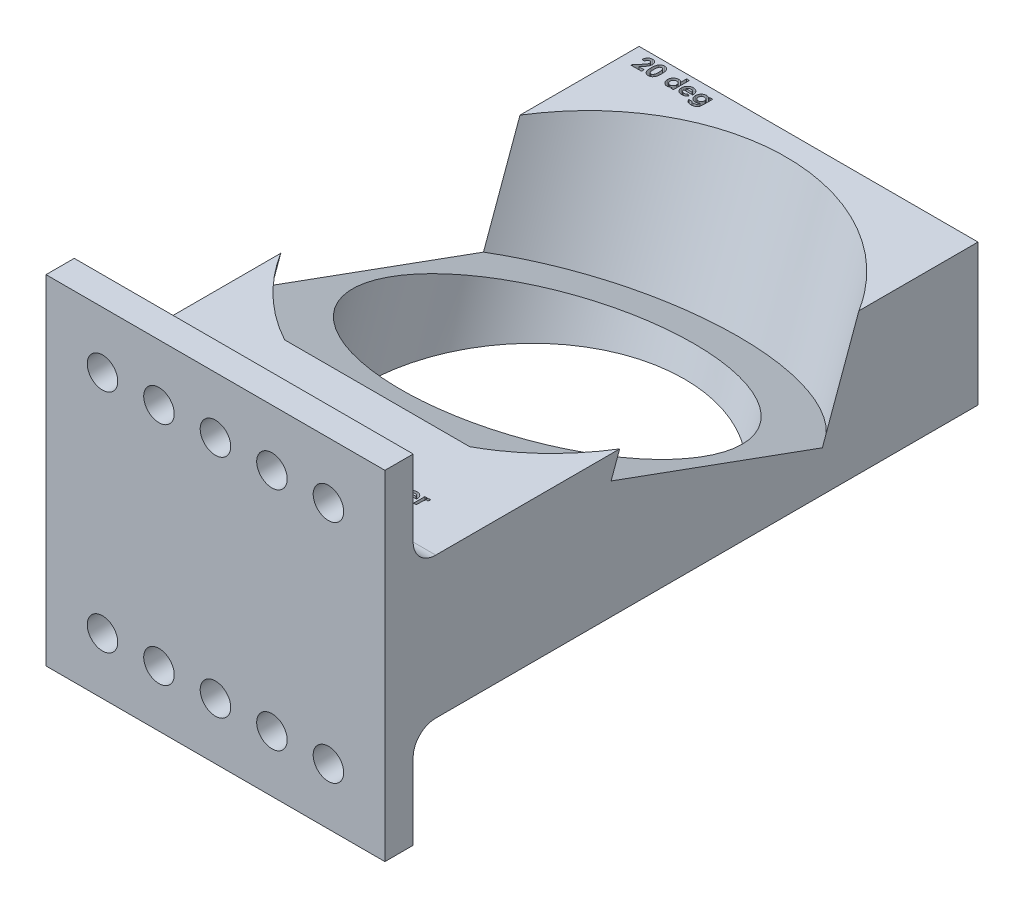
from build123d import *

# Parameters (mm, degrees)
SKETCH1_W           = 127
SKETCH1_H           = 31.75
BOSS_EXTRUDE1_DEPTH = 38.1
SKETCH3_W           = 76.2
SKETCH3_H           = 76.2
SKETCH3_R           = 3.429
BOSS_EXTRUDE2_DEPTH = 6.35
FILLET1_R           = 5.08
SKETCH4_W           = 0.628205128
SKETCH4_H           = 2.557692308
SKETCH4_W_2         = 0.628205129
SKETCH4_H_2         = 3.58974359
CUT_EXTRUDE1_DEPTH  = 2.54


with BuildPart() as part:
    # Sketch1 → Boss-Extrude1 (new, symmetric)
    with BuildSketch(Plane(origin=(0, 0, 0), x_dir=(0, 0, -1), z_dir=(1, 0, 0))):
        Rectangle(SKETCH1_W, SKETCH1_H)
    extrude(amount=BOSS_EXTRUDE1_DEPTH, both=True)

    # Sketch2 → Cut-Revolve1 (revolve, cut)
    with BuildSketch(Plane(origin=(0, 0, 0), x_dir=(0, 0, -1), z_dir=(1, 0, 0))):
        Polygon((37.698479082, -10.037990196), (26.588105744, -40.563490064), (-6.35, -28.575), (16.056795225, 32.987163922), (59.019541847, 17.35000297), (47.72311996, -13.686661085), align=None)
    revolve(axis=Axis((0, -11.128518386, 0), (0, 0.9396926207859105, -0.3420201433256628)), mode=Mode.SUBTRACT)

    # Sketch3 → Boss-Extrude2 (add)
    with BuildSketch(Plane.XY.offset(63.5)):
        Rectangle(SKETCH3_W, SKETCH3_H)
        with Locations((-25.4, 25.4)):
            Circle(SKETCH3_R, mode=Mode.SUBTRACT)
        with Locations((-12.7, 25.4)):
            Circle(SKETCH3_R, mode=Mode.SUBTRACT)
        with Locations((0, 25.4)):
            Circle(SKETCH3_R, mode=Mode.SUBTRACT)
        with Locations((12.7, 25.4)):
            Circle(SKETCH3_R, mode=Mode.SUBTRACT)
        with Locations((-12.7, -25.4)):
            Circle(SKETCH3_R, mode=Mode.SUBTRACT)
        with Locations((0, -25.4)):
            Circle(SKETCH3_R, mode=Mode.SUBTRACT)
        with Locations((12.7, -25.4)):
            Circle(SKETCH3_R, mode=Mode.SUBTRACT)
        with Locations((-25.4, -25.4)):
            Circle(SKETCH3_R, mode=Mode.SUBTRACT)
        with Locations((25.4, 25.4)):
            Circle(SKETCH3_R, mode=Mode.SUBTRACT)
        with Locations((25.4, -25.4)):
            Circle(SKETCH3_R, mode=Mode.SUBTRACT)
    extrude(amount=BOSS_EXTRUDE2_DEPTH)

    # Fillet1
    fillet1_edges = [part.edges().sort_by_distance(p)[0] for p in [
        (0, 15.875, 63.5),
        (0, -15.875, 63.5),
    ]]
    fillet(fillet1_edges, radius=FILLET1_R)

    # Sketch4 → Cut-Extrude1 (cut)
    # profile 1 of 26: a face of its own
    with BuildSketch(Plane(origin=(0, 15.875, 0), x_dir=(1, 0, 0), z_dir=(0, 1, 0))):
        with BuildLine():
            Line((-25.217948718, -48.152564103), (-25.846153846, -48.152564103))
            add(Edge.make_bspline(
                [(-25.846153846, -48.152564103), (-25.841718479, -48.121162369), (-25.833023236, -48.059601351), (-25.812216681, -47.970476333), (-25.787329796, -47.885935154), (-25.756259792, -47.806245538), (-25.719819732, -47.731265532), (-25.678380171, -47.660737841), (-25.631493131, -47.594965184), (-25.595553719, -47.555343474), (-25.577624199, -47.535576923)],
                knots=[0, 0, 0, 0, 1.111473889, 2.178970933, 3.205615836, 4.199322666, 5.174200091, 6.12565194, 7.064921805, 8, 8, 8, 8], degree=3))
            add(Edge.make_bspline(
                [(-25.577624199, -47.535576923), (-25.551763242, -47.509496391), (-25.500794014, -47.458094403), (-25.415618456, -47.392254135), (-25.326338741, -47.33527386), (-25.231164325, -47.290099486), (-25.131576195, -47.253536064), (-25.02678239, -47.228976331), (-24.917211137, -47.212680731), (-24.842442541, -47.211075557), (-24.804286859, -47.21025641)],
                knots=[0, 0, 0, 0, 1.01925491, 2.00884431, 2.983262333, 3.955970413, 4.92937149, 5.924503185, 6.940838805, 8, 8, 8, 8], degree=3))
            add(Edge.make_bspline(
                [(-24.804286859, -47.21025641), (-24.770364495, -47.211057251), (-24.703679962, -47.212631542), (-24.605670479, -47.225269097), (-24.512226638, -47.247433961), (-24.422360712, -47.276414024), (-24.337394335, -47.315846242), (-24.255452217, -47.361618655), (-24.178823824, -47.417760421), (-24.10732986, -47.481194967), (-24.041649018, -47.549805638), (-23.984769121, -47.623144803), (-23.935868453, -47.699253404), (-23.895580771, -47.778763759), (-23.864605018, -47.86181041), (-23.843106927, -47.947913606), (-23.829035904, -48.036883356), (-23.827634063, -48.097354896), (-23.826923077, -48.12802484)],
                knots=[0, 0, 0, 0, 1.091422571, 2.145516843, 3.172569842, 4.178562979, 5.178154469, 6.181868002, 7.194278174, 8.227918432, 9.254613415, 10.245994977, 11.209837596, 12.161663635, 13.10878368, 14.055455738, 15.013766427, 16, 16, 16, 16], degree=3))
            add(Edge.make_bspline(
                [(-23.826923077, -48.12802484), (-23.828382062, -48.166007011), (-23.831254355, -48.240782229), (-23.854823601, -48.350221317), (-23.891715879, -48.454864614), (-23.945010363, -48.553248005), (-24.011642042, -48.645103745), (-24.09339688, -48.727360821), (-24.187946288, -48.801308911), (-24.258925788, -48.841048624), (-24.295272436, -48.861398237)],
                knots=[0, 0, 0, 0, 0.992805628, 1.954529043, 2.915727527, 3.886831945, 4.871318353, 5.87440735, 6.911542536, 8, 8, 8, 8], degree=3))
            add(Edge.make_bspline(
                [(-24.295272436, -48.861398237), (-24.270324655, -48.869589119), (-24.221303384, -48.885683834), (-24.151625541, -48.917382195), (-24.085369874, -48.952023248), (-24.023677283, -48.99226702), (-23.965934159, -49.036486232), (-23.912492512, -49.085058884), (-23.863033039, -49.137879066), (-23.818363148, -49.19523727), (-23.778716874, -49.256216161), (-23.743144383, -49.319407164), (-23.71386624, -49.385768582), (-23.689064009, -49.454542523), (-23.670181001, -49.52634709), (-23.656885677, -49.600904047), (-23.649200653, -49.678043325), (-23.648028556, -49.730305139), (-23.647435897, -49.756730769)],
                knots=[0, 0, 0, 0, 1.059543567, 2.081955587, 3.086750234, 4.076226789, 5.052108497, 6.020845489, 6.989030705, 7.970690546, 8.952259656, 9.923888338, 10.895517021, 11.877585046, 12.873342345, 13.889638361, 14.932918083, 16, 16, 16, 16], degree=3))
            add(Edge.make_bspline(
                [(-23.647435897, -49.756730769), (-23.648637296, -49.795565717), (-23.651006209, -49.872140324), (-23.666066648, -49.984926884), (-23.694106474, -50.092458848), (-23.730994417, -50.195973534), (-23.78019893, -50.294134606), (-23.838104369, -50.389194724), (-23.909281788, -50.477857232), (-23.988383269, -50.562466136), (-24.076230074, -50.639388762), (-24.171470302, -50.706077218), (-24.272009702, -50.763307779), (-24.378484358, -50.809769178), (-24.490857279, -50.84554977), (-24.608877995, -50.871413631), (-24.733042396, -50.887237569), (-24.817794315, -50.888896408), (-24.861077724, -50.88974359)],
                knots=[0, 0, 0, 0, 1.005138573, 1.981928558, 2.936866704, 3.876260664, 4.820238198, 5.773547, 6.751179199, 7.756627054, 8.768222608, 9.766606018, 10.760583154, 11.757261445, 12.767156078, 13.807575856, 14.880313354, 16, 16, 16, 16], degree=3))
            add(Edge.make_bspline(
                [(-24.861077724, -50.88974359), (-24.902023131, -50.88885038), (-24.982086457, -50.887103827), (-25.099195827, -50.871986526), (-25.210497198, -50.847601092), (-25.316274612, -50.813227802), (-25.416118827, -50.768651518), (-25.510935267, -50.715571165), (-25.598831892, -50.650925194), (-25.680788043, -50.577631843), (-25.754985685, -50.495400866), (-25.821300904, -50.406137101), (-25.878271438, -50.309501116), (-25.926130923, -50.205905778), (-25.964505207, -50.095169352), (-25.994774729, -49.977517024), (-26.015918486, -49.85271894), (-26.022357861, -49.766855203), (-26.025641026, -49.723076923)],
                knots=[0, 0, 0, 0, 1.066544725, 2.085487077, 3.070979577, 4.031932826, 4.977951092, 5.916076795, 6.857635327, 7.814973522, 8.776389752, 9.738577119, 10.707772778, 11.69409279, 12.707140348, 13.757286496, 14.856535458, 16, 16, 16, 16], degree=3))
            Line((-26.025641026, -49.723076923), (-25.397435897, -49.723076923))
            add(Edge.make_bspline(
                [(-25.397435897, -49.723076923), (-25.393455027, -49.745089217), (-25.385701238, -49.787963931), (-25.370577948, -49.850036987), (-25.350870191, -49.907334251), (-25.328083121, -49.96036498), (-25.303469655, -50.009825449), (-25.273730701, -50.053888962), (-25.241045375, -50.093752021), (-25.193880212, -50.141141666), (-25.126454362, -50.189832548), (-25.035407127, -50.232147241), (-24.934125699, -50.256948849), (-24.863319881, -50.25997457), (-24.826722756, -50.261538462)],
                knots=[0, 0, 0, 0, 0.928156231, 1.807827665, 2.648129825, 3.438902246, 4.202261636, 4.936546065, 5.639352463, 6.338805438, 7.70633318, 9.064371875, 10.482673459, 12, 12, 12, 12], degree=3))
            add(Edge.make_bspline(
                [(-24.826722756, -50.261538462), (-24.807303029, -50.261205445), (-24.769264126, -50.260553141), (-24.713390643, -50.253323225), (-24.660163283, -50.241415548), (-24.609482908, -50.225233455), (-24.561026883, -50.20494819), (-24.515721009, -50.178791555), (-24.47264184, -50.148380733), (-24.432257684, -50.114190896), (-24.394941892, -50.076936213), (-24.363892959, -50.03568298), (-24.33551648, -49.993762322), (-24.314529032, -49.948431642), (-24.296139506, -49.902130215), (-24.284884177, -49.853177444), (-24.276385595, -49.802600226), (-24.275891692, -49.767987398), (-24.275641026, -49.750420673)],
                knots=[0, 0, 0, 0, 1.110435564, 2.175094844, 3.216326037, 4.226890168, 5.215276772, 6.21526065, 7.213097102, 8.228249917, 9.239874822, 10.221364777, 11.178138315, 12.128914389, 13.072518965, 14.022636769, 14.996447288, 16, 16, 16, 16], degree=3))
            add(Edge.make_bspline(
                [(-24.275641026, -49.750420673), (-24.276306498, -49.731208466), (-24.2776313, -49.692961364), (-24.288455071, -49.63714776), (-24.305548094, -49.583459572), (-24.329292391, -49.532134556), (-24.361000253, -49.483361885), (-24.398415176, -49.436163032), (-24.444484839, -49.392994614), (-24.495029428, -49.350323941), (-24.553641295, -49.313127983), (-24.61746596, -49.278801579), (-24.688180833, -49.251488359), (-24.764059703, -49.227092595), (-24.846537887, -49.209274308), (-24.935103229, -49.196336494), (-25.029612857, -49.186706297), (-25.094759573, -49.185324687), (-25.128205128, -49.184615385)],
                knots=[0, 0, 0, 0, 0.809814727, 1.612155564, 2.388397, 3.182215007, 3.988903953, 4.837162975, 5.715530372, 6.646997145, 7.623086902, 8.637258368, 9.698941581, 10.815059213, 11.996518529, 13.252603015, 14.589518788, 16, 16, 16, 16], degree=3))
            Line((-25.128205128, -49.184615385), (-25.128205128, -48.601282051))
            add(Edge.make_bspline(
                [(-25.128205128, -48.601282051), (-25.086563423, -48.59773571), (-25.008660038, -48.591101209), (-24.900525963, -48.575586197), (-24.809491011, -48.554847828), (-24.733367156, -48.529828109), (-24.670158784, -48.497696271), (-24.614940299, -48.462224142), (-24.567383527, -48.421028447), (-24.527191676, -48.375337637), (-24.495039446, -48.326269992), (-24.47228397, -48.274588168), (-24.457257443, -48.221891265), (-24.455833681, -48.185848172), (-24.455128205, -48.167988782)],
                knots=[0, 0, 0, 0, 1.70044513, 3.18119609, 4.440695891, 5.496282586, 6.431922213, 7.318171381, 8.16090191, 8.983045123, 9.787564368, 10.536848927, 11.275007137, 12, 12, 12, 12], degree=3))
            add(Edge.make_bspline(
                [(-24.455128205, -48.167988782), (-24.456345353, -48.14520214), (-24.458720967, -48.100727438), (-24.477171274, -48.037074771), (-24.509198917, -47.980333694), (-24.552142362, -47.930623606), (-24.604470443, -47.889102015), (-24.665808127, -47.858958048), (-24.734824384, -47.841247122), (-24.783381038, -47.839411095), (-24.80849359, -47.838461538)],
                knots=[0, 0, 0, 0, 1.009664648, 1.970651636, 2.907870547, 3.878035693, 4.867062054, 5.849714035, 6.887914197, 8, 8, 8, 8], degree=3))
            add(Edge.make_bspline(
                [(-24.80849359, -47.838461538), (-24.831255294, -47.839581916), (-24.876421487, -47.841805087), (-24.942467979, -47.858398251), (-25.005190143, -47.886330778), (-25.063289179, -47.924848086), (-25.115926415, -47.97110574), (-25.159126399, -48.02588833), (-25.195058098, -48.085913735), (-25.210288599, -48.130260218), (-25.217948718, -48.152564103)],
                knots=[0, 0, 0, 0, 0.98818071, 1.960853194, 2.938124878, 3.957524365, 4.978590984, 5.968022688, 6.978025184, 8, 8, 8, 8], degree=3))
        make_face()
    # profile 2 of 26: a face of its own
    with BuildSketch(Plane(origin=(0, 15.875, 0), x_dir=(1, 0, 0), z_dir=(0, 1, 0))):
        with BuildLine():
            add(Edge.make_bspline(
                [(-22.154747596, -47.21025641), (-22.124339861, -47.210707822), (-22.064550128, -47.211595417), (-21.976491107, -47.221208799), (-21.891665922, -47.235731937), (-21.809742728, -47.255986651), (-21.731311216, -47.282793043), (-21.655800545, -47.314879835), (-21.58410951, -47.353930044), (-21.515323822, -47.398039262), (-21.449469978, -47.447977149), (-21.388130727, -47.50490892), (-21.330185886, -47.56752457), (-21.276889746, -47.636770737), (-21.227062048, -47.712017553), (-21.180866519, -47.79327695), (-21.138656795, -47.880946639), (-21.099959807, -47.975184826), (-21.065356838, -48.077404101), (-21.0362108, -48.188776963), (-21.011213196, -48.309328847), (-20.990113454, -48.439359824), (-20.974165459, -48.579042736), (-20.96341619, -48.728284786), (-20.956039532, -48.886798256), (-20.955437501, -48.995537194), (-20.955128205, -49.051402244)],
                knots=[0, 0, 0, 0, 0.879237366, 1.728815576, 2.559023295, 3.367336655, 4.166867292, 4.954216142, 5.737608147, 6.525189134, 7.316157332, 8.124696809, 8.942788509, 9.781158001, 10.649253743, 11.551476218, 12.482711956, 13.461909668, 14.496590415, 15.601789533, 16.789733467, 18.056700938, 19.410929216, 20.8549011, 22.384193279, 24, 24, 24, 24], degree=3))
            add(Edge.make_bspline(
                [(-20.955128205, -49.051402244), (-20.95546247, -49.107966228), (-20.956111942, -49.217869035), (-20.96310954, -49.37783235), (-20.975159735, -49.528157986), (-20.990690895, -49.668830392), (-21.011964336, -49.799775281), (-21.036878493, -49.921331711), (-21.066484592, -50.033455622), (-21.102227372, -50.135894375), (-21.140690126, -50.230298065), (-21.183015312, -50.317796819), (-21.228465206, -50.398627631), (-21.275997326, -50.474009945), (-21.328217558, -50.541721529), (-21.382584195, -50.604064929), (-21.441464457, -50.658665407), (-21.502379259, -50.708336825), (-21.567560155, -50.751262898), (-21.636334953, -50.788805334), (-21.709929787, -50.819256709), (-21.787003149, -50.845741688), (-21.86886877, -50.864755045), (-21.954225816, -50.87984152), (-22.044037952, -50.888179231), (-22.105185671, -50.889213579), (-22.136518429, -50.88974359)],
                knots=[0, 0, 0, 0, 1.643780988, 3.193836972, 4.651895693, 6.025988579, 7.305620092, 8.505800249, 9.631074763, 10.672816429, 11.65661981, 12.592235626, 13.49536222, 14.350718032, 15.179365177, 15.97804903, 16.751647189, 17.51006938, 18.259804725, 19.016521909, 19.783502495, 20.571750527, 21.382245291, 22.22305063, 23.089471752, 24, 24, 24, 24], degree=3))
            add(Edge.make_bspline(
                [(-22.136518429, -50.88974359), (-22.167850342, -50.889203355), (-22.229229099, -50.888145043), (-22.319284096, -50.879903514), (-22.405093491, -50.86469393), (-22.487606801, -50.845595718), (-22.566249744, -50.81931531), (-22.641399413, -50.787952852), (-22.71247797, -50.750644662), (-22.77968222, -50.707618575), (-22.842782711, -50.658279496), (-22.902760023, -50.603155162), (-22.959481482, -50.542385299), (-23.012084214, -50.475289235), (-23.061429701, -50.402762561), (-23.107003346, -50.323977059), (-23.148777762, -50.239047439), (-23.188059659, -50.147855316), (-23.222190655, -50.04843743), (-23.252565657, -49.939905991), (-23.277448059, -49.8213563), (-23.297460152, -49.692826443), (-23.313437796, -49.554588715), (-23.325323327, -49.406576394), (-23.332359793, -49.248720538), (-23.333002454, -49.140218345), (-23.333333333, -49.084354968)],
                knots=[0, 0, 0, 0, 0.917216111, 1.796812873, 2.643793957, 3.46689424, 4.273913431, 5.068098542, 5.848489301, 6.620921603, 7.401012384, 8.190319798, 9.003608147, 9.831726257, 10.68377682, 11.569763213, 12.493818149, 13.453288342, 14.474581811, 15.568529029, 16.750744269, 18.018426408, 19.375425659, 20.823733699, 22.36466933, 24, 24, 24, 24], degree=3))
            add(Edge.make_bspline(
                [(-23.333333333, -49.084354968), (-23.332733975, -49.006737203), (-23.331577507, -48.856972725), (-23.316921886, -48.640606598), (-23.295411153, -48.440613594), (-23.263816981, -48.257328251), (-23.224751224, -48.090071735), (-23.174725488, -47.939945844), (-23.117774827, -47.804873248), (-23.069245547, -47.724855429), (-23.045873397, -47.686318109)],
                knots=[0, 0, 0, 0, 1.288568992, 2.486310467, 3.599230591, 4.627010532, 5.572937695, 6.447898582, 7.252493626, 8, 8, 8, 8], degree=3))
            add(Edge.make_bspline(
                [(-23.045873397, -47.686318109), (-23.018697375, -47.648459058), (-22.965562898, -47.574437152), (-22.872655778, -47.477260226), (-22.772839174, -47.394149761), (-22.66406291, -47.32698662), (-22.548047327, -47.274021762), (-22.423796374, -47.236613279), (-22.291768887, -47.214817353), (-22.20110341, -47.211799428), (-22.154747596, -47.21025641)],
                knots=[0, 0, 0, 0, 1.058512271, 2.069600068, 3.047294572, 4.004278952, 4.967380941, 5.939006123, 6.946246673, 8, 8, 8, 8], degree=3))
        make_face()
        with BuildLine():
            add(Edge.make_bspline(
                [(-22.139322917, -47.838461538), (-22.166811762, -47.839764455), (-22.22070449, -47.842318863), (-22.298905407, -47.864002185), (-22.372643989, -47.897493244), (-22.428734958, -47.937794497), (-22.470718491, -47.976428082), (-22.500052687, -48.011390219), (-22.528340895, -48.050405445), (-22.553326465, -48.095234315), (-22.576919365, -48.144266076), (-22.59997674, -48.197723302), (-22.618877733, -48.256919019), (-22.637447458, -48.320845115), (-22.653716269, -48.391268978), (-22.667345966, -48.468766244), (-22.679522903, -48.553840886), (-22.688016461, -48.646548628), (-22.695935007, -48.746792474), (-22.701611395, -48.854795729), (-22.70398455, -48.970529256), (-22.704738904, -49.050233219), (-22.705128205, -49.091366186)],
                knots=[0, 0, 0, 0, 1.076674018, 2.110852608, 3.161083442, 4.239746716, 4.804137807, 5.395870207, 6.026861976, 6.692161227, 7.405688833, 8.16177676, 8.973626916, 9.841385931, 10.773283133, 11.807421078, 12.927755683, 14.143907515, 15.458935494, 16.872852025, 18.386167141, 20, 20, 20, 20], degree=3))
            add(Edge.make_bspline(
                [(-22.705128205, -49.091366186), (-22.704487463, -49.144655933), (-22.703258793, -49.246842974), (-22.696823594, -49.393791497), (-22.683924772, -49.527526485), (-22.667881241, -49.648954311), (-22.645347446, -49.757287482), (-22.619420857, -49.85355093), (-22.587403825, -49.93651753), (-22.550401975, -50.007387166), (-22.509420759, -50.067675819), (-22.464933846, -50.118921445), (-22.418455856, -50.163297739), (-22.368536061, -50.199344056), (-22.315293553, -50.226968292), (-22.25917281, -50.246838064), (-22.200138168, -50.259001178), (-22.159711854, -50.260687811), (-22.139322917, -50.261538462)],
                knots=[0, 0, 0, 0, 1.771748488, 3.397459088, 4.888034009, 6.237357457, 7.467047327, 8.564189669, 9.548206622, 10.417051504, 11.216568818, 11.965764335, 12.669334354, 13.348544111, 14.005342236, 14.656555988, 15.322436492, 16, 16, 16, 16], degree=3))
            add(Edge.make_bspline(
                [(-22.139322917, -50.261538462), (-22.119633663, -50.260956383), (-22.081084553, -50.259816747), (-22.024871318, -50.248118531), (-21.971712088, -50.229099773), (-21.921767368, -50.202196405), (-21.874858513, -50.167984656), (-21.831214784, -50.126314185), (-21.791165334, -50.076769634), (-21.767832342, -50.040000251), (-21.755809295, -50.021053686)],
                knots=[0, 0, 0, 0, 0.992283464, 1.942767638, 2.88273346, 3.832339453, 4.79467288, 5.803907806, 6.868395428, 8, 8, 8, 8], degree=3))
            add(Edge.make_bspline(
                [(-21.755809295, -50.021053686), (-21.741654182, -49.995163811), (-21.711972057, -49.940874842), (-21.677623852, -49.849264233), (-21.648711447, -49.745942606), (-21.623826963, -49.630588415), (-21.606807494, -49.50274669), (-21.592150348, -49.363228085), (-21.585080842, -49.211330042), (-21.583930948, -49.10609453), (-21.583333333, -49.051402244)],
                knots=[0, 0, 0, 0, 0.710965849, 1.490837728, 2.352621235, 3.297892224, 4.334225155, 5.461620853, 6.680770821, 8, 8, 8, 8], degree=3))
            add(Edge.make_bspline(
                [(-21.583333333, -49.051402244), (-21.583564179, -48.996235202), (-21.584008518, -48.890048065), (-21.592160845, -48.737603937), (-21.603513583, -48.598371527), (-21.620119361, -48.472661684), (-21.641485714, -48.360169239), (-21.667819824, -48.260901546), (-21.698865781, -48.174662967), (-21.735682585, -48.101539495), (-21.776459484, -48.039394574), (-21.819745407, -47.986079053), (-21.865723385, -47.940559606), (-21.914316527, -47.902664936), (-21.966649538, -47.873710565), (-22.021722791, -47.853266384), (-22.079649189, -47.840898341), (-22.119163193, -47.839284769), (-22.139322917, -47.838461538)],
                knots=[0, 0, 0, 0, 1.793836731, 3.452829483, 4.963243077, 6.335886805, 7.574563692, 8.684454726, 9.672768357, 10.54971625, 11.340229787, 12.085688095, 12.778991901, 13.440269426, 14.083255152, 14.715733572, 15.344777694, 16, 16, 16, 16], degree=3))
        make_face(mode=Mode.SUBTRACT)
    # profile 3 of 26: a face of its own
    with BuildSketch(Plane(origin=(0, 15.875, 0), x_dir=(1, 0, 0), z_dir=(0, 1, 0))):
        with BuildLine():
            add(Edge.make_bspline(
                [(-19.462439904, -47.21025641), (-19.432032168, -47.210707822), (-19.372242436, -47.211595417), (-19.284183414, -47.221208799), (-19.19935823, -47.235731937), (-19.117435036, -47.255986651), (-19.039003524, -47.282793043), (-18.963492852, -47.314879835), (-18.891801818, -47.353930044), (-18.82301613, -47.398039262), (-18.757162285, -47.447977149), (-18.695823035, -47.50490892), (-18.637878193, -47.56752457), (-18.584582053, -47.636770737), (-18.534754356, -47.712017553), (-18.488558826, -47.79327695), (-18.446349103, -47.880946639), (-18.407652115, -47.975184826), (-18.373049146, -48.077404101), (-18.343903108, -48.188776963), (-18.318905504, -48.309328847), (-18.297805762, -48.439359824), (-18.281857767, -48.579042736), (-18.271108498, -48.728284786), (-18.26373184, -48.886798256), (-18.263129809, -48.995537194), (-18.262820513, -49.051402244)],
                knots=[0, 0, 0, 0, 0.879237366, 1.728815576, 2.559023295, 3.367336655, 4.166867292, 4.954216142, 5.737608147, 6.525189134, 7.316157332, 8.124696809, 8.942788509, 9.781158001, 10.649253743, 11.551476218, 12.482711956, 13.461909668, 14.496590415, 15.601789533, 16.789733467, 18.056700938, 19.410929216, 20.8549011, 22.384193279, 24, 24, 24, 24], degree=3))
            add(Edge.make_bspline(
                [(-18.262820513, -49.051402244), (-18.263154778, -49.107966228), (-18.26380425, -49.217869035), (-18.270801848, -49.37783235), (-18.282852042, -49.528157986), (-18.298383203, -49.668830392), (-18.319656644, -49.799775281), (-18.344570801, -49.921331711), (-18.3741769, -50.033455622), (-18.40991968, -50.135894375), (-18.448382434, -50.230298065), (-18.490707619, -50.317796819), (-18.536157514, -50.398627631), (-18.583689634, -50.474009945), (-18.635909866, -50.541721529), (-18.690276502, -50.604064929), (-18.749156765, -50.658665407), (-18.810071566, -50.708336825), (-18.875252463, -50.751262898), (-18.944027261, -50.788805334), (-19.017622095, -50.819256709), (-19.094695457, -50.845741688), (-19.176561077, -50.864755045), (-19.261918124, -50.87984152), (-19.351730259, -50.888179231), (-19.412877979, -50.889213579), (-19.444210737, -50.88974359)],
                knots=[0, 0, 0, 0, 1.643780988, 3.193836972, 4.651895693, 6.025988579, 7.305620092, 8.505800249, 9.631074763, 10.672816429, 11.65661981, 12.592235626, 13.49536222, 14.350718032, 15.179365177, 15.97804903, 16.751647189, 17.51006938, 18.259804725, 19.016521909, 19.783502495, 20.571750527, 21.382245291, 22.22305063, 23.089471752, 24, 24, 24, 24], degree=3))
            add(Edge.make_bspline(
                [(-19.444210737, -50.88974359), (-19.47554265, -50.889203355), (-19.536921407, -50.888145043), (-19.626976403, -50.879903514), (-19.712785799, -50.86469393), (-19.795299108, -50.845595718), (-19.873942052, -50.81931531), (-19.94909172, -50.787952852), (-20.020170277, -50.750644662), (-20.087374528, -50.707618575), (-20.150475019, -50.658279496), (-20.21045233, -50.603155162), (-20.267173789, -50.542385299), (-20.319776522, -50.475289235), (-20.369122009, -50.402762561), (-20.414695654, -50.323977059), (-20.456470069, -50.239047439), (-20.495751966, -50.147855316), (-20.529882963, -50.04843743), (-20.560257964, -49.939905991), (-20.585140367, -49.8213563), (-20.60515246, -49.692826443), (-20.621130104, -49.554588715), (-20.633015634, -49.406576394), (-20.640052101, -49.248720538), (-20.640694761, -49.140218345), (-20.641025641, -49.084354968)],
                knots=[0, 0, 0, 0, 0.917216111, 1.796812873, 2.643793957, 3.46689424, 4.273913431, 5.068098542, 5.848489301, 6.620921603, 7.401012384, 8.190319798, 9.003608147, 9.831726257, 10.68377682, 11.569763213, 12.493818149, 13.453288342, 14.474581811, 15.568529029, 16.750744269, 18.018426408, 19.375425659, 20.823733699, 22.36466933, 24, 24, 24, 24], degree=3))
            add(Edge.make_bspline(
                [(-20.641025641, -49.084354968), (-20.640426283, -49.006737203), (-20.639269815, -48.856972725), (-20.624614194, -48.640606598), (-20.603103461, -48.440613594), (-20.571509288, -48.257328251), (-20.532443532, -48.090071735), (-20.482417796, -47.939945844), (-20.425467134, -47.804873248), (-20.376937854, -47.724855429), (-20.353565705, -47.686318109)],
                knots=[0, 0, 0, 0, 1.288568992, 2.486310467, 3.599230591, 4.627010532, 5.572937695, 6.447898582, 7.252493626, 8, 8, 8, 8], degree=3))
            add(Edge.make_bspline(
                [(-20.353565705, -47.686318109), (-20.326389683, -47.648459058), (-20.273255205, -47.574437152), (-20.180348086, -47.477260226), (-20.080531482, -47.394149761), (-19.971755218, -47.32698662), (-19.855739635, -47.274021762), (-19.731488682, -47.236613279), (-19.599461195, -47.214817353), (-19.508795718, -47.211799428), (-19.462439904, -47.21025641)],
                knots=[0, 0, 0, 0, 1.058512271, 2.069600068, 3.047294572, 4.004278952, 4.967380941, 5.939006123, 6.946246673, 8, 8, 8, 8], degree=3))
        make_face()
        with BuildLine():
            add(Edge.make_bspline(
                [(-19.447015224, -47.838461538), (-19.474504069, -47.839764455), (-19.528396798, -47.842318863), (-19.606597714, -47.864002185), (-19.680336296, -47.897493244), (-19.736427266, -47.937794497), (-19.778410799, -47.976428082), (-19.807744994, -48.011390219), (-19.836033203, -48.050405445), (-19.861018773, -48.095234315), (-19.884611673, -48.144266076), (-19.907669048, -48.197723302), (-19.926570041, -48.256919019), (-19.945139765, -48.320845115), (-19.961408577, -48.391268978), (-19.975038274, -48.468766244), (-19.987215211, -48.553840886), (-19.995708769, -48.646548628), (-20.003627314, -48.746792474), (-20.009303703, -48.854795729), (-20.011676858, -48.970529256), (-20.012431212, -49.050233219), (-20.012820513, -49.091366186)],
                knots=[0, 0, 0, 0, 1.076674018, 2.110852608, 3.161083442, 4.239746716, 4.804137807, 5.395870207, 6.026861976, 6.692161227, 7.405688833, 8.16177676, 8.973626916, 9.841385931, 10.773283133, 11.807421078, 12.927755683, 14.143907515, 15.458935494, 16.872852025, 18.386167141, 20, 20, 20, 20], degree=3))
            add(Edge.make_bspline(
                [(-20.012820513, -49.091366186), (-20.012179771, -49.144655933), (-20.010951101, -49.246842974), (-20.004515902, -49.393791497), (-19.991617079, -49.527526485), (-19.975573548, -49.648954311), (-19.953039754, -49.757287482), (-19.927113165, -49.85355093), (-19.895096132, -49.93651753), (-19.858094282, -50.007387166), (-19.817113066, -50.067675819), (-19.772626154, -50.118921445), (-19.726148164, -50.163297739), (-19.676228369, -50.199344056), (-19.622985861, -50.226968292), (-19.566865118, -50.246838064), (-19.507830476, -50.259001178), (-19.467404161, -50.260687811), (-19.447015224, -50.261538462)],
                knots=[0, 0, 0, 0, 1.771748488, 3.397459088, 4.888034009, 6.237357457, 7.467047327, 8.564189669, 9.548206622, 10.417051504, 11.216568818, 11.965764335, 12.669334354, 13.348544111, 14.005342236, 14.656555988, 15.322436492, 16, 16, 16, 16], degree=3))
            add(Edge.make_bspline(
                [(-19.447015224, -50.261538462), (-19.427325971, -50.260956383), (-19.388776861, -50.259816747), (-19.332563626, -50.248118531), (-19.279404396, -50.229099773), (-19.229459676, -50.202196405), (-19.182550821, -50.167984656), (-19.138907092, -50.126314185), (-19.098857641, -50.076769634), (-19.07552465, -50.040000251), (-19.063501603, -50.021053686)],
                knots=[0, 0, 0, 0, 0.992283464, 1.942767638, 2.88273346, 3.832339453, 4.79467288, 5.803907806, 6.868395428, 8, 8, 8, 8], degree=3))
            add(Edge.make_bspline(
                [(-19.063501603, -50.021053686), (-19.049346489, -49.995163811), (-19.019664365, -49.940874842), (-18.98531616, -49.849264233), (-18.956403755, -49.745942606), (-18.931519271, -49.630588415), (-18.914499801, -49.50274669), (-18.899842655, -49.363228085), (-18.89277315, -49.211330042), (-18.891623256, -49.10609453), (-18.891025641, -49.051402244)],
                knots=[0, 0, 0, 0, 0.710965849, 1.490837728, 2.352621235, 3.297892224, 4.334225155, 5.461620853, 6.680770821, 8, 8, 8, 8], degree=3))
            add(Edge.make_bspline(
                [(-18.891025641, -49.051402244), (-18.891256487, -48.996235202), (-18.891700825, -48.890048065), (-18.899853152, -48.737603937), (-18.91120589, -48.598371527), (-18.927811669, -48.472661684), (-18.949178021, -48.360169239), (-18.975512131, -48.260901546), (-19.006558088, -48.174662967), (-19.043374893, -48.101539495), (-19.084151792, -48.039394574), (-19.127437715, -47.986079053), (-19.173415692, -47.940559606), (-19.222008834, -47.902664936), (-19.274341846, -47.873710565), (-19.329415098, -47.853266384), (-19.387341496, -47.840898341), (-19.4268555, -47.839284769), (-19.447015224, -47.838461538)],
                knots=[0, 0, 0, 0, 1.793836731, 3.452829483, 4.963243077, 6.335886805, 7.574563692, 8.684454726, 9.672768357, 10.54971625, 11.340229787, 12.085688095, 12.778991901, 13.440269426, 14.083255152, 14.715733572, 15.344777694, 16, 16, 16, 16], degree=3))
        make_face(mode=Mode.SUBTRACT)
    # profile 4 of 26: a face of its own
    with BuildSketch(Plane(origin=(0, 15.875, 0), x_dir=(1, 0, 0), z_dir=(0, 1, 0))):
        Polygon((-16.423076923, -47.21025641), (-15.794871795, -47.21025641), (-15.794871795, -49.30380609), (-14.817508013, -48.242307692), (-14.041366186, -48.242307692), (-15.163862179, -49.461558494), (-13.880809295, -50.8), (-14.671674679, -50.8), (-15.794871795, -49.628425481), (-15.794871795, -50.8), (-16.423076923, -50.8), align=None)
    # profile 5 of 26: a face of its own
    with BuildSketch(Plane(origin=(0, 15.875, 0), x_dir=(1, 0, 0), z_dir=(0, 1, 0))):
        Polygon((-13.506410256, -47.3), (-12.878205128, -47.3), (-12.878205128, -48.646153846), (-11.666666667, -48.646153846), (-11.666666667, -47.3), (-11.038461538, -47.3), (-11.038461538, -50.8), (-11.666666667, -50.8), (-11.666666667, -49.274358974), (-12.878205128, -49.274358974), (-12.878205128, -50.8), (-13.506410256, -50.8), align=None)
    # profile 6 of 26: a face of its own
    with BuildSketch(Plane(origin=(0, 15.875, 0), x_dir=(1, 0, 0), z_dir=(0, 1, 0))):
        Polygon((-10.41025641, -48.242307692), (-8.435897436, -48.242307692), (-9.612379808, -50.261538462), (-8.525641026, -50.261538462), (-8.525641026, -50.8), (-10.58974359, -50.8), (-9.413261218, -48.780769231), (-10.41025641, -48.780769231), align=None)
    # profile 7 of 26: a face of its own
    with BuildSketch(Plane(origin=(0, 15.875, 0), x_dir=(1, 0, 0), z_dir=(0, 1, 0))):
        with BuildLine():
            Line((-4.846153846, -47.767648237), (-5.315905449, -48.197435897))
            add(Edge.make_bspline(
                [(-5.315905449, -48.197435897), (-5.336027593, -48.169051521), (-5.374659304, -48.114557476), (-5.437277279, -48.041588666), (-5.499612501, -47.97934084), (-5.562242468, -47.928074042), (-5.62572231, -47.888099756), (-5.689941834, -47.859797519), (-5.754536961, -47.841805519), (-5.797934916, -47.839565082), (-5.819310897, -47.838461538)],
                knots=[0, 0, 0, 0, 1.299362458, 2.494594718, 3.587462134, 4.587049575, 5.512617175, 6.380583204, 7.202344345, 8, 8, 8, 8], degree=3))
            add(Edge.make_bspline(
                [(-5.819310897, -47.838461538), (-5.8392498, -47.839160794), (-5.877746582, -47.840510874), (-5.932626602, -47.853930563), (-5.981349864, -47.877090975), (-6.023868818, -47.907375163), (-6.057550103, -47.943860588), (-6.084441998, -47.982124417), (-6.099584394, -48.024359032), (-6.101577431, -48.053367468), (-6.102564103, -48.067728365)],
                knots=[0, 0, 0, 0, 1.185010067, 2.2879431, 3.333075148, 4.379039566, 5.372662701, 6.27520591, 7.14612461, 8, 8, 8, 8], degree=3))
            add(Edge.make_bspline(
                [(-6.102564103, -48.067728365), (-6.101945805, -48.082296353), (-6.100700641, -48.111634255), (-6.088674047, -48.154632605), (-6.070546536, -48.196646998), (-6.053224959, -48.222223158), (-6.044370994, -48.235296474)],
                knots=[0, 0, 0, 0, 0.967525499, 1.948461899, 2.951351359, 4, 4, 4, 4], degree=3))
            add(Edge.make_bspline(
                [(-6.044370994, -48.235296474), (-6.036321781, -48.245458226), (-6.017793557, -48.268849236), (-5.982464027, -48.30589695), (-5.938097559, -48.351283643), (-5.882986835, -48.403448599), (-5.819419654, -48.464267874), (-5.744449596, -48.531350639), (-5.660234624, -48.606774369), (-5.600376574, -48.659296724), (-5.569010417, -48.68681891)],
                knots=[0, 0, 0, 0, 0.473873513, 1.090794244, 1.870441696, 2.795289791, 3.865433203, 5.087734844, 6.473946851, 8, 8, 8, 8], degree=3))
            add(Edge.make_bspline(
                [(-5.569010417, -48.68681891), (-5.539568766, -48.712299174), (-5.48369463, -48.76065542), (-5.404196831, -48.829289347), (-5.334331505, -48.891037619), (-5.273080875, -48.944973524), (-5.22137344, -48.991662974), (-5.178991823, -49.031329145), (-5.145418403, -49.063199809), (-5.126333879, -49.082449709), (-5.118189103, -49.090665064)],
                knots=[0, 0, 0, 0, 1.543621617, 2.929473131, 4.163658386, 5.240097082, 6.164993805, 6.925417477, 7.541396219, 8, 8, 8, 8], degree=3))
            add(Edge.make_bspline(
                [(-5.118189103, -49.090665064), (-5.087289518, -49.124105032), (-5.027889665, -49.188388395), (-4.950690796, -49.288007389), (-4.88715363, -49.385255841), (-4.838000074, -49.481963637), (-4.800877331, -49.579526078), (-4.774705305, -49.680335878), (-4.759030705, -49.785446436), (-4.757290458, -49.857171561), (-4.756410256, -49.893449519)],
                knots=[0, 0, 0, 0, 1.206664779, 2.319633467, 3.337109185, 4.282041471, 5.190008762, 6.099243693, 7.03861361, 8, 8, 8, 8], degree=3))
            add(Edge.make_bspline(
                [(-4.756410256, -49.893449519), (-4.757036762, -49.928797941), (-4.758265988, -49.998152859), (-4.773321656, -50.099643451), (-4.794790154, -50.196774353), (-4.827984219, -50.288488642), (-4.868440949, -50.376291782), (-4.919159302, -50.458816077), (-4.978721054, -50.536896708), (-5.046987967, -50.609137888), (-5.122499279, -50.674691752), (-5.203492337, -50.73304935), (-5.290759133, -50.78123098), (-5.383554073, -50.820905116), (-5.481827485, -50.851462666), (-5.585462297, -50.874047543), (-5.694617025, -50.887602631), (-5.769258601, -50.889019654), (-5.807391827, -50.88974359)],
                knots=[0, 0, 0, 0, 1.043214005, 2.046824704, 3.02475056, 3.976699089, 4.921714032, 5.875962561, 6.831408892, 7.817874052, 8.806269674, 9.781291748, 10.760897367, 11.74438705, 12.757449933, 13.795994037, 14.874007457, 16, 16, 16, 16], degree=3))
            add(Edge.make_bspline(
                [(-5.807391827, -50.88974359), (-5.837326085, -50.889212536), (-5.896613082, -50.888160745), (-5.983993154, -50.879573749), (-6.068368491, -50.865715249), (-6.149644051, -50.84585188), (-6.228185997, -50.820682298), (-6.303997553, -50.789938617), (-6.376555367, -50.753144322), (-6.446408446, -50.71105605), (-6.513217217, -50.662186023), (-6.577826452, -50.607533371), (-6.63959439, -50.546257513), (-6.69881769, -50.478503364), (-6.755117425, -50.40407906), (-6.810336487, -50.324021098), (-6.862020775, -50.23684371), (-6.893948458, -50.175688067), (-6.91025641, -50.144451122)],
                knots=[0, 0, 0, 0, 1.016823716, 2.013894106, 2.979844003, 3.91962641, 4.853723003, 5.779685073, 6.695824784, 7.614987388, 8.547259901, 9.504950863, 10.487499108, 11.500346958, 12.559593716, 13.656357062, 14.802919212, 16, 16, 16, 16], degree=3))
            Line((-6.91025641, -50.144451122), (-6.357772436, -49.812820513))
            add(Edge.make_bspline(
                [(-6.357772436, -49.812820513), (-6.337373625, -49.848278527), (-6.298267362, -49.91625457), (-6.231998143, -50.007588999), (-6.164108711, -50.085801818), (-6.093029523, -50.149510612), (-6.019624876, -50.199567249), (-5.943540209, -50.235341194), (-5.864722065, -50.257485226), (-5.811034726, -50.260189524), (-5.784254808, -50.261538462)],
                knots=[0, 0, 0, 0, 1.283663364, 2.460892379, 3.537111102, 4.529833553, 5.449777664, 6.316464042, 7.160231139, 8, 8, 8, 8], degree=3))
            add(Edge.make_bspline(
                [(-5.784254808, -50.261538462), (-5.757015797, -50.260436846), (-5.704168148, -50.258299551), (-5.628734893, -50.238558004), (-5.559574828, -50.207562327), (-5.499793379, -50.16333577), (-5.449174217, -50.112291601), (-5.41181437, -50.055502629), (-5.388344662, -49.994058332), (-5.385863345, -49.951375082), (-5.384615385, -49.929907853)],
                knots=[0, 0, 0, 0, 1.13588714, 2.203786484, 3.234766741, 4.283437687, 5.291419208, 6.222934724, 7.106237994, 8, 8, 8, 8], degree=3))
            add(Edge.make_bspline(
                [(-5.384615385, -49.929907853), (-5.385767825, -49.909936089), (-5.388108897, -49.869365364), (-5.405352513, -49.80904322), (-5.432309544, -49.748748508), (-5.464201613, -49.699293155), (-5.496655786, -49.657885528), (-5.527689296, -49.622007693), (-5.565479901, -49.582368966), (-5.609931782, -49.538919484), (-5.660457614, -49.491276752), (-5.717099956, -49.439445434), (-5.780507426, -49.383882102), (-5.82532395, -49.34603291), (-5.848758013, -49.326241987)],
                knots=[0, 0, 0, 0, 0.916159276, 1.861089862, 2.860218735, 3.940849679, 4.552606315, 5.27541173, 6.11797699, 7.06649574, 8.129236253, 9.306560635, 10.591630461, 12, 12, 12, 12], degree=3))
            add(Edge.make_bspline(
                [(-5.848758013, -49.326241987), (-5.893307099, -49.288549188), (-5.97881028, -49.216205298), (-6.099637122, -49.10935565), (-6.208512926, -49.009494863), (-6.304497323, -48.91538844), (-6.388813302, -48.828774309), (-6.46088984, -48.748948955), (-6.519935142, -48.675296636), (-6.58206759, -48.588060394), (-6.641105839, -48.481757038), (-6.69213164, -48.353861777), (-6.725235025, -48.225982745), (-6.728943799, -48.140131806), (-6.730769231, -48.097876603)],
                knots=[0, 0, 0, 0, 1.345494975, 2.582412109, 3.71882943, 4.751509156, 5.681369928, 6.505683931, 7.230279997, 7.856715994, 8.973648664, 10.023341002, 11.027102913, 12, 12, 12, 12], degree=3))
            add(Edge.make_bspline(
                [(-6.730769231, -48.097876603), (-6.730010036, -48.06791148), (-6.728514342, -48.00887697), (-6.715172514, -47.922075325), (-6.695232645, -47.838319031), (-6.66627423, -47.757913669), (-6.628689705, -47.680959949), (-6.583044758, -47.607081152), (-6.528630611, -47.536957241), (-6.467309541, -47.470634703), (-6.399749422, -47.410023451), (-6.327552849, -47.356527948), (-6.251128461, -47.311344868), (-6.170943784, -47.273862222), (-6.086501946, -47.245171638), (-5.998425028, -47.224834322), (-5.906586698, -47.212738335), (-5.844120249, -47.211094026), (-5.812299679, -47.21025641)],
                knots=[0, 0, 0, 0, 1.010766082, 1.991317756, 2.957454644, 3.913069143, 4.869106762, 5.843196583, 6.838735724, 7.860187025, 8.887984031, 9.89767229, 10.887916223, 11.879572884, 12.879850636, 13.892031539, 14.926195476, 16, 16, 16, 16], degree=3))
            add(Edge.make_bspline(
                [(-5.812299679, -47.21025641), (-5.771061797, -47.21176498), (-5.688911549, -47.214770211), (-5.567450038, -47.238270136), (-5.448811513, -47.275226244), (-5.353210366, -47.319809722), (-5.277142317, -47.362997758), (-5.218843264, -47.402759861), (-5.159520839, -47.448309488), (-5.098696644, -47.499790176), (-5.037500887, -47.55817189), (-4.97419348, -47.622064808), (-4.909637063, -47.692021113), (-4.867685627, -47.741997573), (-4.846153846, -47.767648237)],
                knots=[0, 0, 0, 0, 1.282922637, 2.555718331, 3.837320111, 5.142675274, 5.830281639, 6.55870424, 7.337177975, 8.157850921, 9.037902056, 9.96903443, 10.957596896, 12, 12, 12, 12], degree=3))
        make_face()
    # profile 8 of 26: a face of its own
    with BuildSketch(Plane(origin=(0, 15.875, 0), x_dir=(1, 0, 0), z_dir=(0, 1, 0))):
        with BuildLine():
            Line((-2.288461538, -48.242307692), (-1.66025641, -48.242307692))
            Line((-1.66025641, -48.242307692), (-1.66025641, -50.8))
            Line((-1.66025641, -50.8), (-2.288461538, -50.8))
            Line((-2.288461538, -50.8), (-2.288461538, -50.520953526))
            add(Edge.make_bspline(
                [(-2.288461538, -50.520953526), (-2.319588871, -50.548115612), (-2.380000877, -50.600831856), (-2.475190649, -50.669232524), (-2.570658578, -50.725654235), (-2.666863387, -50.770591051), (-2.765283706, -50.803772264), (-2.866628121, -50.827796237), (-2.972356099, -50.841963762), (-3.044228522, -50.843892353), (-3.080729167, -50.844871795)],
                knots=[0, 0, 0, 0, 1.129196829, 2.191548051, 3.199897424, 4.157751732, 5.089409408, 6.034969131, 7.002052659, 8, 8, 8, 8], degree=3))
            add(Edge.make_bspline(
                [(-3.080729167, -50.844871795), (-3.121702763, -50.843950017), (-3.202668911, -50.842128532), (-3.321477745, -50.822954463), (-3.436199485, -50.793604276), (-3.54674101, -50.752070092), (-3.6529012, -50.698249934), (-3.755492501, -50.633548042), (-3.852756187, -50.555692995), (-3.945501944, -50.468053382), (-4.030419403, -50.371649183), (-4.104655047, -50.267818477), (-4.167230178, -50.158033872), (-4.218494634, -50.042659355), (-4.258820749, -49.921779604), (-4.287567499, -49.795011226), (-4.304528114, -49.662308945), (-4.30662736, -49.571917349), (-4.307692308, -49.526061699)],
                knots=[0, 0, 0, 0, 0.980476535, 1.937477201, 2.874147792, 3.812856188, 4.758993464, 5.720109578, 6.712210464, 7.737600662, 8.772720504, 9.783789959, 10.789002326, 11.793715968, 12.802552247, 13.835794126, 14.902098527, 16, 16, 16, 16], degree=3))
            add(Edge.make_bspline(
                [(-4.307692308, -49.526061699), (-4.306574641, -49.478578113), (-4.304382214, -49.385433768), (-4.288344741, -49.248748872), (-4.260128477, -49.118837282), (-4.221653573, -48.995519054), (-4.17216229, -48.878772881), (-4.111885214, -48.768407498), (-4.040002332, -48.66471138), (-3.957170053, -48.56944951), (-3.867731536, -48.482137405), (-3.772048135, -48.406125293), (-3.671616128, -48.341549467), (-3.566328789, -48.288830533), (-3.456201153, -48.248092009), (-3.341668003, -48.218308821), (-3.222220891, -48.200437863), (-3.140852551, -48.198444863), (-3.099659455, -48.197435897)],
                knots=[0, 0, 0, 0, 1.136281865, 2.228943489, 3.287578264, 4.313574083, 5.316051562, 6.317280042, 7.318008486, 8.329309503, 9.333984563, 10.305318864, 11.248632312, 12.186624717, 13.117503092, 14.05354244, 15.014596925, 16, 16, 16, 16], degree=3))
            add(Edge.make_bspline(
                [(-3.099659455, -48.197435897), (-3.061501301, -48.198228641), (-2.986000068, -48.199797195), (-2.875024134, -48.216828689), (-2.767393484, -48.242587613), (-2.663695249, -48.279289445), (-2.563078861, -48.325632973), (-2.467274985, -48.383704869), (-2.374187826, -48.451064395), (-2.317390023, -48.503673613), (-2.288461538, -48.53046875)],
                knots=[0, 0, 0, 0, 1.017011718, 2.012299608, 2.98747302, 3.965332399, 4.941441765, 5.936729654, 6.94912688, 8, 8, 8, 8], degree=3))
            Line((-2.288461538, -48.53046875), (-2.288461538, -48.242307692))
        make_face()
        with BuildLine():
            add(Edge.make_bspline(
                [(-2.967848558, -48.780769231), (-2.99288068, -48.781537303), (-3.041942006, -48.783042674), (-3.114093399, -48.792097584), (-3.183048487, -48.80805274), (-3.248315487, -48.831623056), (-3.310867116, -48.860335136), (-3.36975352, -48.896296543), (-3.425460704, -48.938802162), (-3.477661049, -48.986822933), (-3.525249356, -49.03960654), (-3.566273253, -49.097204891), (-3.601136938, -49.158066039), (-3.630622555, -49.222372971), (-3.651727566, -49.290886638), (-3.668442727, -49.362715114), (-3.677116813, -49.4384452), (-3.678689152, -49.490052909), (-3.679487179, -49.516245994)],
                knots=[0, 0, 0, 0, 1.04836806, 2.054732945, 3.03993516, 4.00574415, 4.955904794, 5.917688631, 6.888591924, 7.88601754, 8.884115178, 9.859153345, 10.841239365, 11.818093293, 12.814750328, 13.83810466, 14.90274714, 16, 16, 16, 16], degree=3))
            add(Edge.make_bspline(
                [(-3.679487179, -49.516245994), (-3.678701342, -49.542676664), (-3.677152857, -49.594757995), (-3.668302475, -49.671126891), (-3.652188795, -49.744004612), (-3.628679544, -49.81280199), (-3.599969294, -49.87844733), (-3.565022464, -49.940637673), (-3.522096404, -49.998273416), (-3.474466382, -50.052718413), (-3.421195154, -50.101335682), (-3.365172756, -50.144503354), (-3.305633966, -50.180621717), (-3.243224737, -50.209812806), (-3.178155141, -50.233601091), (-3.109609404, -50.249355723), (-3.038259018, -50.259427361), (-2.989617575, -50.260829902), (-2.965044071, -50.261538462)],
                knots=[0, 0, 0, 0, 1.099136573, 2.165835871, 3.191374663, 4.196217796, 5.183857741, 6.167377911, 7.154730987, 8.166690795, 9.170734848, 10.148332609, 11.103258353, 12.059567475, 13.009337315, 13.978056681, 14.978520572, 16, 16, 16, 16], degree=3))
            add(Edge.make_bspline(
                [(-2.965044071, -50.261538462), (-2.939545695, -50.260766084), (-2.889555019, -50.259251803), (-2.816226512, -50.250279528), (-2.74634511, -50.234265872), (-2.680201557, -50.21056061), (-2.616785574, -50.182054626), (-2.556669433, -50.146795932), (-2.500505484, -50.104387852), (-2.448009283, -50.055932972), (-2.399906635, -50.002718355), (-2.35831541, -49.944364693), (-2.322087931, -49.882738295), (-2.293596685, -49.81638209), (-2.270970641, -49.746457), (-2.254736976, -49.672529056), (-2.245906804, -49.594518555), (-2.244371862, -49.541273349), (-2.243589744, -49.514142628)],
                knots=[0, 0, 0, 0, 1.050008698, 2.058587853, 3.036635738, 3.995319155, 4.947022481, 5.895997462, 6.858296291, 7.838991643, 8.833936038, 9.806048392, 10.784806122, 11.771666913, 12.772873988, 13.80724452, 14.882696879, 16, 16, 16, 16], degree=3))
            add(Edge.make_bspline(
                [(-2.243589744, -49.514142628), (-2.244362144, -49.487478543), (-2.245870865, -49.43539584), (-2.254775058, -49.359014162), (-2.271123973, -49.286537825), (-2.293284336, -49.21783361), (-2.322282449, -49.153058607), (-2.358537339, -49.092931017), (-2.399672333, -49.035367645), (-2.448307547, -48.98359065), (-2.500519364, -48.93548662), (-2.557509295, -48.894360991), (-2.617481847, -48.858917783), (-2.680805493, -48.829817542), (-2.748066581, -48.808485962), (-2.818067405, -48.7919697), (-2.891900124, -48.783048108), (-2.942119282, -48.781541253), (-2.967848558, -48.780769231)],
                knots=[0, 0, 0, 0, 1.106611376, 2.161533483, 3.185006901, 4.184773755, 5.152708835, 6.122342771, 7.094156588, 8.082475533, 9.064254463, 10.03606828, 10.992420271, 11.951521816, 12.920622147, 13.915721683, 14.932141191, 16, 16, 16, 16], degree=3))
        make_face(mode=Mode.SUBTRACT)
    # profile 9 of 26: a face of its own
    with BuildSketch(Plane(origin=(0, 15.875, 0), x_dir=(1, 0, 0), z_dir=(0, 1, 0))):
        with BuildLine():
            Line((-1.032051282, -48.242307692), (-0.403846154, -48.242307692))
            Line((-0.403846154, -48.242307692), (-0.403846154, -48.512940705))
            add(Edge.make_bspline(
                [(-0.403846154, -48.512940705), (-0.368007363, -48.485064555), (-0.299512466, -48.431787814), (-0.195388397, -48.363859697), (-0.097108167, -48.308263261), (-0.002481005, -48.265973767), (0.090273502, -48.235548294), (0.182657579, -48.213689407), (0.276047012, -48.199692561), (0.338827381, -48.198187715), (0.370192308, -48.197435897)],
                knots=[0, 0, 0, 0, 1.276643801, 2.439914479, 3.493451431, 4.44993799, 5.350072675, 6.235028322, 7.118224225, 8, 8, 8, 8], degree=3))
            add(Edge.make_bspline(
                [(0.370192308, -48.197435897), (0.402007805, -48.198295069), (0.4644643, -48.199981696), (0.556428045, -48.211778281), (0.644290474, -48.2332636), (0.729039525, -48.261790293), (0.809812598, -48.299443891), (0.887599213, -48.34415143), (0.960728542, -48.398608237), (1.00576482, -48.440079927), (1.028545673, -48.461057692)],
                knots=[0, 0, 0, 0, 1.048836932, 2.058954983, 3.049370783, 4.026390553, 5.001981509, 5.982488534, 6.97947532, 8, 8, 8, 8], degree=3))
            add(Edge.make_bspline(
                [(1.028545673, -48.461057692), (1.046816756, -48.480497947), (1.083492645, -48.519520735), (1.129644643, -48.586298721), (1.169248248, -48.659098948), (1.2016979, -48.738761191), (1.225676885, -48.825723143), (1.244124246, -48.918934426), (1.254475382, -49.018916956), (1.255753278, -49.08760401), (1.256410256, -49.122916667)],
                knots=[0, 0, 0, 0, 0.889584746, 1.785680191, 2.700364693, 3.65222533, 4.649950538, 5.707241244, 6.821271309, 8, 8, 8, 8], degree=3))
            Line((1.256410256, -49.122916667), (1.256410256, -50.8))
            Line((1.256410256, -50.8), (0.628205128, -50.8))
            Line((0.628205128, -50.8), (0.628205128, -49.689423077))
            add(Edge.make_bspline(
                [(0.628205128, -49.689423077), (0.628072277, -49.653197992), (0.627817691, -49.583779342), (0.62586304, -49.48443082), (0.622046421, -49.394706203), (0.618567673, -49.314442128), (0.611737507, -49.243923587), (0.605577953, -49.182704143), (0.596126715, -49.131339185), (0.583829121, -49.076088465), (0.562354492, -49.016932466), (0.529016178, -48.954601847), (0.486721852, -48.901650598), (0.437198983, -48.857707502), (0.380502264, -48.822944482), (0.317316794, -48.798486533), (0.247981321, -48.783243738), (0.199669179, -48.781615053), (0.174579327, -48.780769231)],
                knots=[0, 0, 0, 0, 1.49886392, 2.872294502, 4.110984203, 5.214877267, 6.195405875, 7.042225351, 7.75923308, 8.355011229, 9.382752534, 10.352059385, 11.267231453, 12.171456522, 13.078624015, 14.003401117, 14.963110155, 16, 16, 16, 16], degree=3))
            add(Edge.make_bspline(
                [(0.174579327, -48.780769231), (0.141948919, -48.782423927), (0.078117499, -48.785660836), (-0.014201881, -48.810070078), (-0.098995694, -48.851583015), (-0.175571103, -48.909028571), (-0.243198793, -48.979952229), (-0.298898753, -49.064536827), (-0.344584163, -49.160740921), (-0.364229568, -49.230985536), (-0.374399038, -49.267347756)],
                knots=[0, 0, 0, 0, 0.984188326, 1.925263693, 2.85911992, 3.81709677, 4.80007086, 5.801799564, 6.862098548, 8, 8, 8, 8], degree=3))
            add(Edge.make_bspline(
                [(-0.374399038, -49.267347756), (-0.376926556, -49.278767555), (-0.382563428, -49.304236003), (-0.387199042, -49.347262162), (-0.393647518, -49.398308534), (-0.396063604, -49.458298914), (-0.400264911, -49.526949393), (-0.401818755, -49.604350794), (-0.403375379, -49.690351346), (-0.40368403, -49.750419464), (-0.403846154, -49.781971154)],
                knots=[0, 0, 0, 0, 0.543362196, 1.211806945, 2.009705693, 2.934833164, 4.000995085, 5.207458376, 6.533175157, 8, 8, 8, 8], degree=3))
            Line((-0.403846154, -49.781971154), (-0.403846154, -50.8))
            Line((-0.403846154, -50.8), (-1.032051282, -50.8))
            Line((-1.032051282, -50.8), (-1.032051282, -48.242307692))
        make_face()
    # profile 10 of 26: a face of its own
    with BuildSketch(Plane(origin=(0, 15.875, 0), x_dir=(1, 0, 0), z_dir=(0, 1, 0))):
        with BuildLine():
            Line((3.769230769, -48.242307692), (4.442307692, -48.242307692))
            Line((4.442307692, -48.242307692), (4.442307692, -50.424198718))
            add(Edge.make_bspline(
                [(4.442307692, -50.424198718), (4.441498829, -50.476338965), (4.439936883, -50.577023828), (4.428021909, -50.722942202), (4.408152155, -50.858216561), (4.37956028, -50.983038485), (4.342632499, -51.096949194), (4.297468422, -51.200327385), (4.244986329, -51.293727446), (4.201834366, -51.348303344), (4.180789263, -51.374919872)],
                knots=[0, 0, 0, 0, 1.243822755, 2.401870584, 3.490053692, 4.503076575, 5.453444971, 6.342269266, 7.191528908, 8, 8, 8, 8], degree=3))
            add(Edge.make_bspline(
                [(4.180789263, -51.374919872), (4.150568204, -51.408068927), (4.090279089, -51.474199212), (3.983985999, -51.557653291), (3.867538003, -51.628979993), (3.739746731, -51.687435644), (3.600764394, -51.731960201), (3.450948026, -51.764025818), (3.290202648, -51.783997795), (3.179180116, -51.786099069), (3.122095353, -51.787179487)],
                knots=[0, 0, 0, 0, 0.916003385, 1.827369254, 2.751972866, 3.703651841, 4.69362366, 5.730423306, 6.83304546, 8, 8, 8, 8], degree=3))
            add(Edge.make_bspline(
                [(3.122095353, -51.787179487), (3.061753455, -51.786245322), (2.945700449, -51.784448681), (2.778934672, -51.766873419), (2.627027118, -51.737954538), (2.489264433, -51.697240852), (2.364363153, -51.644708422), (2.249967956, -51.581719008), (2.146298534, -51.506409979), (2.051787877, -51.421750285), (1.968627864, -51.325880757), (1.897617371, -51.219679146), (1.837120123, -51.104122295), (1.807248919, -51.021485928), (1.792067308, -50.979487179)],
                knots=[0, 0, 0, 0, 1.29412125, 2.488928388, 3.592140377, 4.607309753, 5.564519828, 6.493640275, 7.402258018, 8.307438948, 9.210158992, 10.116782752, 11.042881838, 12, 12, 12, 12], degree=3))
            Line((1.792067308, -50.979487179), (2.490384615, -50.979487179))
            add(Edge.make_bspline(
                [(2.490384615, -50.979487179), (2.506521982, -50.997252882), (2.53900179, -51.033010054), (2.596449718, -51.078383483), (2.660000148, -51.117220927), (2.730165802, -51.149022534), (2.807239239, -51.173204805), (2.890695808, -51.191576837), (2.98090933, -51.201930438), (3.04307649, -51.203194566), (3.075120192, -51.203846154)],
                knots=[0, 0, 0, 0, 0.888971165, 1.789239437, 2.70354581, 3.646217955, 4.638595249, 5.694475788, 6.811630907, 8, 8, 8, 8], degree=3))
            add(Edge.make_bspline(
                [(3.075120192, -51.203846154), (3.115615006, -51.203089531), (3.192956551, -51.201644448), (3.302377777, -51.18584404), (3.400093077, -51.162239153), (3.484691883, -51.126714374), (3.557679393, -51.084044228), (3.61856875, -51.034477304), (3.66884565, -50.979881048), (3.701732003, -50.92851931), (3.721274298, -50.881925886), (3.734581435, -50.841693135), (3.744687018, -50.795317588), (3.753885765, -50.743667226), (3.760761978, -50.686076621), (3.765317557, -50.622667779), (3.769267927, -50.553720065), (3.769243429, -50.505769048), (3.769230769, -50.480989583)],
                knots=[0, 0, 0, 0, 1.656375485, 3.163532, 4.516250129, 5.759907703, 6.905105653, 7.965920022, 8.961443813, 9.932912751, 10.442911961, 11.026787936, 11.664959534, 12.383728702, 13.174001396, 14.037595414, 14.985895623, 16, 16, 16, 16], degree=3))
            add(Edge.make_bspline(
                [(3.769230769, -50.480989583), (3.741709294, -50.507982255), (3.68800407, -50.560655573), (3.600822031, -50.627855387), (3.511575775, -50.683360779), (3.419752419, -50.727485135), (3.323525805, -50.759805447), (3.222330759, -50.783018076), (3.115014796, -50.797161901), (3.041275887, -50.799040369), (3.003605769, -50.8)],
                knots=[0, 0, 0, 0, 1.082007397, 2.111422008, 3.08419067, 4.02964304, 4.965866572, 5.929243163, 6.942137121, 8, 8, 8, 8], degree=3))
            add(Edge.make_bspline(
                [(3.003605769, -50.8), (2.961938235, -50.799037401), (2.880088421, -50.797146515), (2.759867888, -50.778770801), (2.644526978, -50.750179984), (2.533755111, -50.710378891), (2.428682593, -50.657537119), (2.327814202, -50.59467015), (2.233019325, -50.518476889), (2.142990154, -50.433210692), (2.061619717, -50.338433583), (1.990018766, -50.236643097), (1.929657367, -50.128541381), (1.880569692, -50.014228928), (1.841459364, -49.894185617), (1.814543132, -49.767761561), (1.798095222, -49.635170223), (1.795960556, -49.544806754), (1.794871795, -49.498717949)],
                knots=[0, 0, 0, 0, 1.007560175, 1.979205489, 2.935124557, 3.879618859, 4.820364716, 5.775815361, 6.749909327, 7.75781854, 8.772289371, 9.766897274, 10.764314289, 11.762244114, 12.772609037, 13.814079916, 14.885097635, 16, 16, 16, 16], degree=3))
            add(Edge.make_bspline(
                [(1.794871795, -49.498717949), (1.79582272, -49.449581039), (1.797681184, -49.353549073), (1.815899435, -49.213282123), (1.844247914, -49.080067254), (1.884716114, -48.954183122), (1.937882247, -48.836167875), (2.002131391, -48.725647041), (2.076857468, -48.62135677), (2.136009401, -48.559487926), (2.165765224, -48.528365385)],
                knots=[0, 0, 0, 0, 1.104124469, 2.157873671, 3.173961494, 4.162551312, 5.124378318, 6.07778831, 7.033049473, 8, 8, 8, 8], degree=3))
            add(Edge.make_bspline(
                [(2.165765224, -48.528365385), (2.194003072, -48.501827922), (2.249647161, -48.449534526), (2.340736361, -48.38243342), (2.43507484, -48.324880718), (2.533956554, -48.278586058), (2.636681816, -48.241719526), (2.743858768, -48.21592846), (2.854954499, -48.200026284), (2.930402014, -48.198305804), (2.968549679, -48.197435897)],
                knots=[0, 0, 0, 0, 1.042068658, 2.053448347, 3.038272799, 4.011764631, 4.986555969, 5.970496305, 6.973845226, 8, 8, 8, 8], degree=3))
            add(Edge.make_bspline(
                [(2.968549679, -48.197435897), (3.004346946, -48.198441072), (3.075281497, -48.20043289), (3.180375682, -48.214486004), (3.282141092, -48.239312871), (3.381691987, -48.273444592), (3.480083523, -48.317658351), (3.577230677, -48.375608999), (3.675103077, -48.444901596), (3.737206534, -48.499044065), (3.769230769, -48.526963141)],
                knots=[0, 0, 0, 0, 0.968122651, 1.918396369, 2.861262201, 3.796768263, 4.761417965, 5.77287463, 6.85156174, 8, 8, 8, 8], degree=3))
            Line((3.769230769, -48.526963141), (3.769230769, -48.242307692))
        make_face()
        with BuildLine():
            add(Edge.make_bspline(
                [(3.118589744, -48.780769231), (3.094029877, -48.781560633), (3.045677829, -48.7831187), (2.974615582, -48.791897002), (2.907177182, -48.808466892), (2.842540713, -48.829982313), (2.781492041, -48.858924816), (2.723913151, -48.894236987), (2.66912155, -48.935224674), (2.618860736, -48.982661327), (2.572272408, -49.033917716), (2.533155222, -49.090328294), (2.498294836, -49.148680951), (2.471185715, -49.211323769), (2.448768849, -49.276556755), (2.435068586, -49.345707367), (2.424121653, -49.417511664), (2.423429689, -49.466653837), (2.423076923, -49.491706731)],
                knots=[0, 0, 0, 0, 1.059154978, 2.085203149, 3.079850876, 4.048488546, 5.017545358, 5.985239295, 6.956545898, 7.961752598, 8.960830395, 9.936516972, 10.916356752, 11.886198968, 12.873933111, 13.883774911, 14.921139228, 16, 16, 16, 16], degree=3))
            add(Edge.make_bspline(
                [(2.423076923, -49.491706731), (2.423458778, -49.517686931), (2.424208216, -49.568676276), (2.434701033, -49.642958226), (2.449689867, -49.714050523), (2.472331735, -49.781085356), (2.500677264, -49.844943525), (2.534726823, -49.905593651), (2.576759102, -49.961585617), (2.623434512, -50.014151643), (2.675070128, -50.061677344), (2.7306513, -50.103014492), (2.789033715, -50.138713374), (2.851479409, -50.166547165), (2.916637251, -50.189102189), (2.985160762, -50.205481644), (3.056892471, -50.214331371), (3.105713573, -50.215880099), (3.130508814, -50.216666667)],
                knots=[0, 0, 0, 0, 1.097915424, 2.154794285, 3.166904039, 4.167166757, 5.140698173, 6.119085138, 7.101657521, 8.095747232, 9.089148684, 10.06378348, 11.021581144, 11.977080764, 12.949256321, 13.934658686, 14.951055324, 16, 16, 16, 16], degree=3))
            add(Edge.make_bspline(
                [(3.130508814, -50.216666667), (3.15485476, -50.216284942), (3.202589466, -50.215536499), (3.272220904, -50.205037321), (3.338748013, -50.189856397), (3.40205098, -50.168147639), (3.461778487, -50.139812997), (3.518732009, -50.105999899), (3.571703448, -50.065082204), (3.621697419, -50.018821934), (3.666813786, -49.967381738), (3.706636435, -49.911646961), (3.739349299, -49.851607538), (3.767213967, -49.788214021), (3.787845025, -49.720572171), (3.803509775, -49.649353682), (3.812698627, -49.574213541), (3.813628544, -49.522814788), (3.814102564, -49.496614583)],
                knots=[0, 0, 0, 0, 1.047368431, 2.053558439, 3.025081491, 3.983010266, 4.928381778, 5.867249904, 6.829345556, 7.804873619, 8.796055618, 9.770545002, 10.747991713, 11.735078325, 12.747239243, 13.787476531, 14.872179528, 16, 16, 16, 16], degree=3))
            add(Edge.make_bspline(
                [(3.814102564, -49.496614583), (3.813642678, -49.470645806), (3.812744727, -49.419940465), (3.803426116, -49.345755056), (3.787897502, -49.275429901), (3.76698067, -49.208384601), (3.739721357, -49.145019537), (3.705538298, -49.085924463), (3.666448517, -49.030008164), (3.620421657, -48.979175296), (3.570811523, -48.932159656), (3.516117587, -48.892385428), (3.459075119, -48.857242356), (3.397758146, -48.829382171), (3.332928289, -48.807438773), (3.264481425, -48.79242824), (3.192766632, -48.78189513), (3.143636499, -48.781149405), (3.118589744, -48.780769231)],
                knots=[0, 0, 0, 0, 1.111098411, 2.169475416, 3.193737863, 4.190319778, 5.171520483, 6.139320596, 7.107999188, 8.085777416, 9.069626166, 10.027970922, 10.974971434, 11.932846196, 12.904000912, 13.89897495, 14.928888274, 16, 16, 16, 16], degree=3))
        make_face(mode=Mode.SUBTRACT)
    # profile 11 of 26: a face of its own
    with BuildSketch(Plane(origin=(0, 15.875, 0), x_dir=(1, 0, 0), z_dir=(0, 1, 0))):
        with BuildLine():
            add(Edge.make_bspline(
                [(5.381109776, -47.165384615), (5.408395583, -47.166785625), (5.461902377, -47.16953297), (5.539007097, -47.193860213), (5.60940629, -47.23379801), (5.671317082, -47.288714038), (5.722726668, -47.35409246), (5.761994022, -47.427298052), (5.783870636, -47.508404863), (5.786908759, -47.56443302), (5.788461538, -47.59306891)],
                knots=[0, 0, 0, 0, 0.995712391, 1.952567401, 2.924528294, 3.935813279, 4.958122237, 5.951926006, 6.953233049, 8, 8, 8, 8], degree=3))
            add(Edge.make_bspline(
                [(5.788461538, -47.59306891), (5.786906882, -47.621244583), (5.783852943, -47.676592363), (5.761840877, -47.7565674), (5.723387066, -47.829586558), (5.671991507, -47.894341443), (5.611296952, -47.949265654), (5.542100878, -47.988604642), (5.467211859, -48.013954909), (5.414732017, -48.016604955), (5.388120994, -48.017948718)],
                knots=[0, 0, 0, 0, 1.043963266, 2.0507425, 3.046578156, 4.083001338, 5.101749035, 6.060256289, 7.016411566, 8, 8, 8, 8], degree=3))
            add(Edge.make_bspline(
                [(5.388120994, -48.017948718), (5.360818764, -48.016608632), (5.307209758, -48.013977321), (5.230166477, -47.988689952), (5.159786838, -47.948091544), (5.097733908, -47.89239515), (5.046255518, -47.825872453), (5.008441516, -47.750944239), (4.984996554, -47.669243666), (4.982201662, -47.612391129), (4.980769231, -47.583253205)],
                knots=[0, 0, 0, 0, 0.987717453, 1.939422218, 2.907780508, 3.916552728, 4.944027764, 5.941049679, 6.944751763, 8, 8, 8, 8], degree=3))
            add(Edge.make_bspline(
                [(4.980769231, -47.583253205), (4.981899653, -47.555262774), (4.984114497, -47.500420894), (5.007955572, -47.422323078), (5.044166639, -47.34998603), (5.095493268, -47.286676989), (5.1559473, -47.232382328), (5.225657648, -47.194134937), (5.301167148, -47.169372625), (5.354035602, -47.166735235), (5.381109776, -47.165384615)],
                knots=[0, 0, 0, 0, 1.041582456, 2.040780965, 3.019867712, 4.044216916, 5.064100433, 6.032405335, 6.992385922, 8, 8, 8, 8], degree=3))
        make_face()
    # profile 12 of 26: a face of its own
    with BuildSketch(Plane(origin=(0, 15.875, 0), x_dir=(1, 0, 0), z_dir=(0, 1, 0))):
        with BuildLine():
            Line((5.070512821, -48.242307692), (5.698717949, -48.242307692))
            Line((5.698717949, -48.242307692), (5.698717949, -50.87431891))
            add(Edge.make_bspline(
                [(5.698717949, -50.87431891), (5.698325882, -50.903532537), (5.697566673, -50.960102592), (5.695234435, -51.042208612), (5.689419661, -51.118652571), (5.681986207, -51.189319057), (5.671988691, -51.254314203), (5.660717515, -51.313742658), (5.645559355, -51.36713772), (5.624865646, -51.430114893), (5.591232441, -51.500275042), (5.541016755, -51.575262769), (5.480053484, -51.639943775), (5.408665326, -51.693257814), (5.328758729, -51.73566184), (5.240616208, -51.766121222), (5.14457093, -51.783407019), (5.078060276, -51.785898652), (5.043870192, -51.787179487)],
                knots=[0, 0, 0, 0, 1.088100884, 2.107027923, 3.058282248, 3.942553477, 4.752511503, 5.506976617, 6.193245016, 6.818034395, 7.974316006, 9.077524124, 10.167294622, 11.267442803, 12.381005417, 13.523313323, 14.726848721, 16, 16, 16, 16], degree=3))
            add(Edge.make_bspline(
                [(5.043870192, -51.787179487), (5.010612963, -51.785779022), (4.939928633, -51.782802498), (4.82865481, -51.762850495), (4.705745187, -51.733022682), (4.621363486, -51.704660673), (4.576923077, -51.689723558)],
                knots=[0, 0, 0, 0, 0.833147864, 1.77075781, 2.825948833, 4, 4, 4, 4], degree=3))
            Line((4.576923077, -51.689723558), (4.576923077, -51.176502404))
            add(Edge.make_bspline(
                [(4.576923077, -51.176502404), (4.600322979, -51.187536914), (4.644937403, -51.208575391), (4.711835284, -51.230557555), (4.774135799, -51.246397027), (4.814750264, -51.24796549), (4.834234776, -51.248717949)],
                knots=[0, 0, 0, 0, 1.150954616, 2.194418511, 3.133784617, 4, 4, 4, 4], degree=3))
            add(Edge.make_bspline(
                [(4.834234776, -51.248717949), (4.852817077, -51.248171187), (4.888023866, -51.247135269), (4.936913608, -51.23236401), (4.978950405, -51.20995853), (5.013774088, -51.176592541), (5.040397987, -51.130413522), (5.058436507, -51.070140499), (5.069092234, -50.995288843), (5.070013221, -50.940498776), (5.070512821, -50.910777244)],
                knots=[0, 0, 0, 0, 0.937393345, 1.776023775, 2.559776585, 3.329653378, 4.183912577, 5.227851547, 6.49621468, 8, 8, 8, 8], degree=3))
            Line((5.070512821, -50.910777244), (5.070512821, -48.242307692))
        make_face()
    # profile 13 of 26: a face of its own
    with BuildSketch(Plane(origin=(0, 15.875, 0), x_dir=(1, 0, 0), z_dir=(0, 1, 0))):
        with BuildLine():
            add(Edge.make_bspline(
                [(6.594751603, -47.165384615), (6.621827239, -47.166713049), (6.67499286, -47.169321555), (6.751159847, -47.194748692), (6.821065705, -47.234655823), (6.882864422, -47.289409358), (6.934262816, -47.354795094), (6.973533098, -47.427998772), (6.995408936, -47.50910609), (6.998447166, -47.565134177), (7, -47.593770032)],
                knots=[0, 0, 0, 0, 0.989868614, 1.943702388, 2.910836514, 3.924849579, 4.949916355, 5.946401046, 6.950409252, 8, 8, 8, 8], degree=3))
            add(Edge.make_bspline(
                [(7, -47.593770032), (6.998502724, -47.622194856), (6.99558521, -47.67758198), (6.973029612, -47.757588229), (6.935335502, -47.830756352), (6.883520814, -47.895170988), (6.822392076, -47.949042685), (6.754013715, -47.989674306), (6.678576628, -48.013686937), (6.626235977, -48.0165135), (6.599659455, -48.017948718)],
                knots=[0, 0, 0, 0, 1.05296456, 2.051751585, 3.055639087, 4.085634717, 5.099016424, 6.062201612, 7.016062274, 8, 8, 8, 8], degree=3))
            add(Edge.make_bspline(
                [(6.599659455, -48.017948718), (6.572347471, -48.016625034), (6.518719311, -48.014025927), (6.441927598, -47.988539297), (6.371089375, -47.94894646), (6.30955874, -47.893074225), (6.25757172, -47.827223875), (6.220016779, -47.752315951), (6.196525235, -47.670654023), (6.193736809, -47.613796123), (6.192307692, -47.584655449)],
                knots=[0, 0, 0, 0, 0.989065327, 1.942068821, 2.907541208, 3.917690034, 4.939857478, 5.938239964, 6.943311734, 8, 8, 8, 8], degree=3))
            add(Edge.make_bspline(
                [(6.192307692, -47.584655449), (6.193862962, -47.556713295), (6.196918066, -47.501824967), (6.218924943, -47.422520903), (6.257294759, -47.350547893), (6.308322925, -47.286359104), (6.369578841, -47.232626928), (6.439442733, -47.193931803), (6.515097114, -47.169554879), (6.56792595, -47.166789057), (6.594751603, -47.165384615)],
                knots=[0, 0, 0, 0, 1.038616768, 2.040212704, 3.031499824, 4.052181184, 5.074969369, 6.039807101, 7.004644834, 8, 8, 8, 8], degree=3))
        make_face()
    # profile 14 of 26: a face of its own
    with BuildSketch(Plane(origin=(0, 15.875, 0), x_dir=(1, 0, 0), z_dir=(0, 1, 0))):
        with Locations((6.596153846, -49.521153846)):
            Rectangle(SKETCH4_W, SKETCH4_H)
    # profile 15 of 26: a face of its own
    with BuildSketch(Plane(origin=(0, 15.875, 0), x_dir=(1, 0, 0), z_dir=(0, 1, 0))):
        with BuildLine():
            Line((7.493589744, -48.242307692), (8.121794872, -48.242307692))
            Line((8.121794872, -48.242307692), (8.121794872, -48.512940705))
            add(Edge.make_bspline(
                [(8.121794872, -48.512940705), (8.157633663, -48.485064555), (8.22612856, -48.431787814), (8.330252629, -48.363859697), (8.428532859, -48.308263261), (8.523160021, -48.265973767), (8.615914527, -48.235548294), (8.708298604, -48.213689407), (8.801688038, -48.199692561), (8.864468406, -48.198187715), (8.895833333, -48.197435897)],
                knots=[0, 0, 0, 0, 1.276643801, 2.439914479, 3.493451431, 4.44993799, 5.350072675, 6.235028322, 7.118224225, 8, 8, 8, 8], degree=3))
            add(Edge.make_bspline(
                [(8.895833333, -48.197435897), (8.927648831, -48.198295069), (8.990105325, -48.199981696), (9.082069071, -48.211778281), (9.169931499, -48.2332636), (9.25468055, -48.261790293), (9.335453624, -48.299443891), (9.413240239, -48.34415143), (9.486369567, -48.398608237), (9.531405845, -48.440079927), (9.554186699, -48.461057692)],
                knots=[0, 0, 0, 0, 1.048836932, 2.058954983, 3.049370783, 4.026390553, 5.001981509, 5.982488534, 6.97947532, 8, 8, 8, 8], degree=3))
            add(Edge.make_bspline(
                [(9.554186699, -48.461057692), (9.572457782, -48.480497947), (9.609133671, -48.519520735), (9.655285668, -48.586298721), (9.694889274, -48.659098948), (9.727338925, -48.738761191), (9.751317911, -48.825723143), (9.769765271, -48.918934426), (9.780116407, -49.018916956), (9.781394304, -49.08760401), (9.782051282, -49.122916667)],
                knots=[0, 0, 0, 0, 0.889584746, 1.785680191, 2.700364693, 3.65222533, 4.649950538, 5.707241244, 6.821271309, 8, 8, 8, 8], degree=3))
            Line((9.782051282, -49.122916667), (9.782051282, -50.8))
            Line((9.782051282, -50.8), (9.153846154, -50.8))
            Line((9.153846154, -50.8), (9.153846154, -49.689423077))
            add(Edge.make_bspline(
                [(9.153846154, -49.689423077), (9.153713302, -49.653197992), (9.153458717, -49.583779342), (9.151504065, -49.48443082), (9.147687447, -49.394706203), (9.144208699, -49.314442128), (9.137378533, -49.243923587), (9.131218979, -49.182704143), (9.121767741, -49.131339185), (9.109470146, -49.076088465), (9.087995518, -49.016932466), (9.054657204, -48.954601847), (9.012362878, -48.901650598), (8.962840008, -48.857707502), (8.90614329, -48.822944482), (8.842957819, -48.798486533), (8.773622347, -48.783243738), (8.725310204, -48.781615053), (8.700220353, -48.780769231)],
                knots=[0, 0, 0, 0, 1.49886392, 2.872294502, 4.110984203, 5.214877267, 6.195405875, 7.042225351, 7.75923308, 8.355011229, 9.382752534, 10.352059385, 11.267231453, 12.171456522, 13.078624015, 14.003401117, 14.963110155, 16, 16, 16, 16], degree=3))
            add(Edge.make_bspline(
                [(8.700220353, -48.780769231), (8.667589945, -48.782423927), (8.603758525, -48.785660836), (8.511439144, -48.810070078), (8.426645332, -48.851583015), (8.350069922, -48.909028571), (8.282442232, -48.979952229), (8.226742273, -49.064536827), (8.181056863, -49.160740921), (8.161411458, -49.230985536), (8.151241987, -49.267347756)],
                knots=[0, 0, 0, 0, 0.984188326, 1.925263693, 2.85911992, 3.81709677, 4.80007086, 5.801799564, 6.862098548, 8, 8, 8, 8], degree=3))
            add(Edge.make_bspline(
                [(8.151241987, -49.267347756), (8.14871447, -49.278767555), (8.143077597, -49.304236003), (8.138441983, -49.347262162), (8.131993507, -49.398308534), (8.129577422, -49.458298914), (8.125376115, -49.526949393), (8.123822271, -49.604350794), (8.122265647, -49.690351346), (8.121956996, -49.750419464), (8.121794872, -49.781971154)],
                knots=[0, 0, 0, 0, 0.543362196, 1.211806945, 2.009705693, 2.934833164, 4.000995085, 5.207458376, 6.533175157, 8, 8, 8, 8], degree=3))
            Line((8.121794872, -49.781971154), (8.121794872, -50.8))
            Line((8.121794872, -50.8), (7.493589744, -50.8))
            Line((7.493589744, -50.8), (7.493589744, -48.242307692))
        make_face()
    # profile 16 of 26: a face of its own
    with BuildSketch(Plane(origin=(0, 15.875, 0), x_dir=(1, 0, 0), z_dir=(0, 1, 0))):
        Polygon((11.846153846, -47.3), (12.474358974, -47.3), (12.474358974, -48.646153846), (13.685897436, -48.646153846), (13.685897436, -47.3), (14.314102564, -47.3), (14.314102564, -50.8), (13.685897436, -50.8), (13.685897436, -49.274358974), (12.474358974, -49.274358974), (12.474358974, -50.8), (11.846153846, -50.8), align=None)
    # profile 17 of 26: a face of its own
    with BuildSketch(Plane(origin=(0, 15.875, 0), x_dir=(1, 0, 0), z_dir=(0, 1, 0))):
        with BuildLine():
            add(Edge.make_bspline(
                [(16.250600962, -48.197435897), (16.280301287, -48.197964435), (16.33912139, -48.199011179), (16.426726585, -48.207724367), (16.512800239, -48.221940292), (16.597837092, -48.240347433), (16.681047498, -48.266138592), (16.762867885, -48.297071098), (16.844029831, -48.332585233), (16.922518912, -48.374859475), (16.998902155, -48.420709747), (17.071318014, -48.471286358), (17.139165128, -48.526192047), (17.203702968, -48.584153782), (17.261923967, -48.647695029), (17.31754876, -48.713754103), (17.367572074, -48.78469767), (17.413886457, -48.858797001), (17.45511982, -48.935623592), (17.490923412, -49.014643011), (17.521997563, -49.094762758), (17.546328001, -49.176958747), (17.566471361, -49.260147114), (17.579183253, -49.345347272), (17.588220527, -49.431683999), (17.589233891, -49.489812988), (17.58974359, -49.519050481)],
                knots=[0, 0, 0, 0, 1.022364134, 2.024744242, 3.027414945, 4.024939316, 5.017584196, 6.023349371, 7.035562955, 8.064994934, 9.090267829, 10.101425541, 11.102933353, 12.093946398, 13.084502048, 14.067315274, 15.065326281, 16.070028806, 17.074376865, 18.064572984, 19.055292013, 20.030201733, 21.013838017, 21.999348303, 22.993720005, 24, 24, 24, 24], degree=3))
            add(Edge.make_bspline(
                [(17.58974359, -49.519050481), (17.589205688, -49.548516391), (17.588136216, -49.607101301), (17.57951021, -49.694250132), (17.565239871, -49.779850946), (17.546762082, -49.864408031), (17.521067442, -49.9468394), (17.491045997, -50.028360124), (17.454193492, -50.107859043), (17.413450333, -50.186203417), (17.366838168, -50.261087809), (17.316858154, -50.33274206), (17.261466346, -50.399286341), (17.203711422, -50.462784377), (17.140853936, -50.521088947), (17.07389721, -50.575146762), (17.003420906, -50.625618704), (16.928918222, -50.671320605), (16.851343415, -50.711477235), (16.772004768, -50.747681715), (16.690438354, -50.777824529), (16.606812978, -50.802405164), (16.521077925, -50.821437335), (16.433422476, -50.834366115), (16.344035407, -50.843357932), (16.28380992, -50.844363925), (16.253405449, -50.844871795)],
                knots=[0, 0, 0, 0, 1.012026251, 2.012137606, 3.004615893, 3.992048833, 4.982446996, 5.968083444, 6.973977695, 7.990229942, 8.999482246, 10.001782172, 10.988562221, 11.971415814, 12.948383116, 13.930088534, 14.925840678, 15.924049238, 16.929462851, 17.924729459, 18.917889337, 19.913673841, 20.916777188, 21.931792057, 22.95587778, 24, 24, 24, 24], degree=3))
            add(Edge.make_bspline(
                [(16.253405449, -50.844871795), (16.208947912, -50.843566878), (16.121321429, -50.840994868), (15.992268338, -50.823377272), (15.868290918, -50.793052771), (15.74918715, -50.750781084), (15.634802315, -50.696611493), (15.526134673, -50.629568398), (15.422103277, -50.550971685), (15.324510029, -50.461485661), (15.235101393, -50.36331139), (15.156992192, -50.258510953), (15.09067116, -50.148655134), (15.036197965, -50.033618659), (14.994155766, -49.913243783), (14.963794125, -49.787890384), (14.94615499, -49.657206112), (14.943604733, -49.568415448), (14.942307692, -49.523257212)],
                knots=[0, 0, 0, 0, 1.029999031, 2.030143771, 3.011211297, 3.982305373, 4.953580601, 5.938004764, 6.935448627, 7.970290061, 9.001484052, 10.007591832, 10.993831261, 11.969999897, 12.951306496, 13.942897864, 14.953773953, 16, 16, 16, 16], degree=3))
            add(Edge.make_bspline(
                [(14.942307692, -49.523257212), (14.943649965, -49.475038114), (14.946288174, -49.380264443), (14.967236719, -49.241418855), (15.000689285, -49.108480785), (15.048708337, -48.981822102), (15.110048452, -48.861209202), (15.184930832, -48.746896471), (15.273725548, -48.638858016), (15.34172452, -48.573512654), (15.376302083, -48.540284455)],
                knots=[0, 0, 0, 0, 1.043912699, 2.05178951, 3.033892, 4.007821512, 4.978932272, 5.95884105, 6.962068106, 8, 8, 8, 8], degree=3))
            add(Edge.make_bspline(
                [(15.376302083, -48.540284455), (15.408030454, -48.512742016), (15.47062396, -48.458406485), (15.572317807, -48.389490772), (15.676440831, -48.329968621), (15.784240992, -48.281030343), (15.896018807, -48.24413167), (16.011201481, -48.217272738), (16.129765061, -48.200775195), (16.210117637, -48.198554653), (16.250600962, -48.197435897)],
                knots=[0, 0, 0, 0, 1.048115528, 2.067714963, 3.060638214, 4.039924844, 5.017819947, 5.994373833, 6.98952318, 8, 8, 8, 8], degree=3))
        make_face()
        with BuildLine():
            add(Edge.make_bspline(
                [(16.264623397, -48.780769231), (16.240301019, -48.781577626), (16.192422155, -48.783168961), (16.121943209, -48.79170923), (16.055283479, -48.809213245), (15.99111898, -48.831473562), (15.930584788, -48.861243599), (15.872023086, -48.896081403), (15.818478954, -48.939676628), (15.76736122, -48.9874974), (15.720957713, -49.040601084), (15.681417518, -49.098457508), (15.646087478, -49.158853207), (15.6192985, -49.223999341), (15.59712806, -49.29211528), (15.582123372, -49.364301567), (15.571681157, -49.439751845), (15.57090597, -49.491435802), (15.570512821, -49.517648237)],
                knots=[0, 0, 0, 0, 1.030650113, 2.02884584, 2.99876339, 3.944280128, 4.900564847, 5.851248946, 6.823638398, 7.81794922, 8.81432732, 9.802856497, 10.78262424, 11.771747962, 12.779760563, 13.812642396, 14.89064281, 16, 16, 16, 16], degree=3))
            add(Edge.make_bspline(
                [(15.570512821, -49.517648237), (15.570972859, -49.544785055), (15.571871916, -49.597818754), (15.581181838, -49.675255085), (15.596534206, -49.748741651), (15.61834511, -49.818164929), (15.645776005, -49.884023233), (15.679430531, -49.945947051), (15.719663875, -50.00356406), (15.765278723, -50.05680331), (15.815225032, -50.105129166), (15.869952294, -50.146600607), (15.927168736, -50.182633785), (15.988192934, -50.211573989), (16.052158172, -50.233918174), (16.119254336, -50.250369446), (16.189834015, -50.259232594), (16.237958201, -50.26075927), (16.262520032, -50.261538462)],
                knots=[0, 0, 0, 0, 1.141730614, 2.231293227, 3.276944405, 4.297399982, 5.28939179, 6.275415646, 7.257752684, 8.24146775, 9.222424823, 10.176631434, 11.126518621, 12.063689483, 13.012557477, 13.974037417, 14.965980454, 16, 16, 16, 16], degree=3))
            add(Edge.make_bspline(
                [(16.262520032, -50.261538462), (16.287094147, -50.260847354), (16.335273679, -50.259492382), (16.40593624, -50.249345779), (16.473375046, -50.233377026), (16.537886597, -50.210840532), (16.598949312, -50.181280879), (16.656796944, -50.145075313), (16.711938386, -50.103027041), (16.76255498, -50.053789368), (16.809409793, -50.000384085), (16.850498661, -49.942462919), (16.884834069, -49.880539085), (16.912995252, -49.815002208), (16.934848913, -49.745942367), (16.94994712, -49.673102876), (16.960394918, -49.59670947), (16.961152573, -49.544327451), (16.961538462, -49.517648237)],
                knots=[0, 0, 0, 0, 1.031504075, 2.022346795, 2.991027682, 3.937587355, 4.885570121, 5.833146507, 6.798790848, 7.791235734, 8.792807298, 9.778388351, 10.766749885, 11.760164525, 12.768777521, 13.802286646, 14.880660483, 16, 16, 16, 16], degree=3))
            add(Edge.make_bspline(
                [(16.961538462, -49.517648237), (16.961072571, -49.490978348), (16.960158342, -49.438643374), (16.950847757, -49.362146647), (16.935646052, -49.289542594), (16.913553836, -49.221141227), (16.886285987, -49.156162197), (16.852608198, -49.094938106), (16.812176436, -49.037770498), (16.766339842, -48.984942842), (16.715644806, -48.937295107), (16.661867741, -48.894804895), (16.603778933, -48.859662226), (16.542468161, -48.830692121), (16.477772307, -48.80840376), (16.409764003, -48.791859254), (16.338234825, -48.783122225), (16.289416983, -48.78156176), (16.264623397, -48.780769231)],
                knots=[0, 0, 0, 0, 1.123894411, 2.205445421, 3.243160173, 4.246488011, 5.231014757, 6.210004299, 7.185865357, 8.177612767, 9.153374344, 10.115157457, 11.061423229, 12.009021698, 12.96873347, 13.94135618, 14.954456845, 16, 16, 16, 16], degree=3))
        make_face(mode=Mode.SUBTRACT)
    # profile 18 of 26: a face of its own
    with BuildSketch(Plane(origin=(0, 15.875, 0), x_dir=(1, 0, 0), z_dir=(0, 1, 0))):
        with Locations((18.397435898, -49.005128205)):
            Rectangle(SKETCH4_W_2, SKETCH4_H_2)
    # profile 19 of 26: a face of its own
    with BuildSketch(Plane(origin=(0, 15.875, 0), x_dir=(1, 0, 0), z_dir=(0, 1, 0))):
        with BuildLine():
            Line((21.224358974, -47.21025641), (21.852564103, -47.21025641))
            Line((21.852564103, -47.21025641), (21.852564103, -50.8))
            Line((21.852564103, -50.8), (21.224358974, -50.8))
            Line((21.224358974, -50.8), (21.224358974, -50.520953526))
            add(Edge.make_bspline(
                [(21.224358974, -50.520953526), (21.193231642, -50.548115612), (21.132819636, -50.600831856), (21.037629863, -50.669232524), (20.942161935, -50.725654235), (20.845957125, -50.770591051), (20.747536807, -50.803772264), (20.646192392, -50.827796237), (20.540464414, -50.841963762), (20.468591991, -50.843892353), (20.432091346, -50.844871795)],
                knots=[0, 0, 0, 0, 1.129196829, 2.191548051, 3.199897424, 4.157751732, 5.089409408, 6.034969131, 7.002052659, 8, 8, 8, 8], degree=3))
            add(Edge.make_bspline(
                [(20.432091346, -50.844871795), (20.39111775, -50.843950017), (20.310151602, -50.842128532), (20.191342768, -50.822954463), (20.076621028, -50.793604276), (19.966079503, -50.752070092), (19.859919313, -50.698249934), (19.757328011, -50.633548042), (19.660064326, -50.555692995), (19.567318569, -50.468053382), (19.48240111, -50.371649183), (19.408165466, -50.267818477), (19.345590335, -50.158033872), (19.294325879, -50.042659355), (19.253999764, -49.921779604), (19.225253014, -49.795011226), (19.208292399, -49.662308945), (19.206193153, -49.571917349), (19.205128205, -49.526061699)],
                knots=[0, 0, 0, 0, 0.980476535, 1.937477201, 2.874147792, 3.812856188, 4.758993464, 5.720109578, 6.712210464, 7.737600662, 8.772720504, 9.783789959, 10.789002326, 11.793715968, 12.802552247, 13.835794126, 14.902098527, 16, 16, 16, 16], degree=3))
            add(Edge.make_bspline(
                [(19.205128205, -49.526061699), (19.206245871, -49.478578113), (19.208438299, -49.385433768), (19.224475772, -49.248748872), (19.252692036, -49.118837282), (19.29116694, -48.995519054), (19.340658223, -48.878772881), (19.400935299, -48.768407498), (19.472818181, -48.66471138), (19.55565046, -48.56944951), (19.645088976, -48.482137405), (19.740772378, -48.406125293), (19.841204385, -48.341549467), (19.946491724, -48.288830533), (20.05661936, -48.248092009), (20.17115251, -48.218308821), (20.290599622, -48.200437863), (20.371967962, -48.198444863), (20.413161058, -48.197435897)],
                knots=[0, 0, 0, 0, 1.136281865, 2.228943489, 3.287578264, 4.313574083, 5.316051562, 6.317280042, 7.318008486, 8.329309503, 9.333984563, 10.305318864, 11.248632312, 12.186624717, 13.117503092, 14.05354244, 15.014596925, 16, 16, 16, 16], degree=3))
            add(Edge.make_bspline(
                [(20.413161058, -48.197435897), (20.451294612, -48.198645754), (20.526703717, -48.201038246), (20.638095954, -48.216098386), (20.745276441, -48.244455315), (20.849546883, -48.280991133), (20.949553127, -48.330155882), (21.045832462, -48.389214516), (21.138638568, -48.458917064), (21.195424278, -48.512819108), (21.224358974, -48.540284455)],
                knots=[0, 0, 0, 0, 1.011899165, 2.001030639, 2.974036179, 3.948778736, 4.92769327, 5.924124564, 6.942254589, 8, 8, 8, 8], degree=3))
            Line((21.224358974, -48.540284455), (21.224358974, -47.21025641))
        make_face()
        with BuildLine():
            add(Edge.make_bspline(
                [(20.544971955, -48.780769231), (20.519939833, -48.781537303), (20.470878507, -48.783042674), (20.398727113, -48.792097584), (20.329772026, -48.80805274), (20.264505026, -48.831623056), (20.201953397, -48.860335136), (20.143066993, -48.896296543), (20.087359809, -48.938802162), (20.035159463, -48.986822933), (19.987571157, -49.03960654), (19.94654726, -49.097204891), (19.911683575, -49.158066039), (19.882197958, -49.222372971), (19.861092946, -49.290886638), (19.844377786, -49.362715114), (19.8357037, -49.4384452), (19.834131361, -49.490052909), (19.833333333, -49.516245994)],
                knots=[0, 0, 0, 0, 1.04836806, 2.054732945, 3.03993516, 4.00574415, 4.955904794, 5.917688631, 6.888591924, 7.88601754, 8.884115178, 9.859153345, 10.841239365, 11.818093293, 12.814750328, 13.83810466, 14.90274714, 16, 16, 16, 16], degree=3))
            add(Edge.make_bspline(
                [(19.833333333, -49.516245994), (19.834119171, -49.542676664), (19.835667655, -49.594757995), (19.844518037, -49.671126891), (19.860631717, -49.744004612), (19.884140969, -49.81280199), (19.912851219, -49.87844733), (19.947798049, -49.940637673), (19.990724109, -49.998273416), (20.038354131, -50.052718413), (20.091625359, -50.101335682), (20.147647757, -50.144503354), (20.207186547, -50.180621717), (20.269595776, -50.209812806), (20.334665371, -50.233601091), (20.403211108, -50.249355723), (20.474561495, -50.259427361), (20.523202938, -50.260829902), (20.547776442, -50.261538462)],
                knots=[0, 0, 0, 0, 1.099136573, 2.165835871, 3.191374663, 4.196217796, 5.183857741, 6.167377911, 7.154730987, 8.166690795, 9.170734848, 10.148332609, 11.103258353, 12.059567475, 13.009337315, 13.978056681, 14.978520572, 16, 16, 16, 16], degree=3))
            add(Edge.make_bspline(
                [(20.547776442, -50.261538462), (20.573274817, -50.260766084), (20.623265494, -50.259251803), (20.696594001, -50.250279528), (20.766475403, -50.234265872), (20.832618955, -50.21056061), (20.896034938, -50.182054626), (20.95615108, -50.146795932), (21.012315029, -50.104387852), (21.064811229, -50.055932972), (21.112913878, -50.002718355), (21.154505103, -49.944364693), (21.190732582, -49.882738295), (21.219223828, -49.81638209), (21.241849872, -49.746457), (21.258083537, -49.672529056), (21.266913709, -49.594518555), (21.268448651, -49.541273349), (21.269230769, -49.514142628)],
                knots=[0, 0, 0, 0, 1.050008698, 2.058587853, 3.036635738, 3.995319155, 4.947022481, 5.895997462, 6.858296291, 7.838991643, 8.833936038, 9.806048392, 10.784806122, 11.771666913, 12.772873988, 13.80724452, 14.882696879, 16, 16, 16, 16], degree=3))
            add(Edge.make_bspline(
                [(21.269230769, -49.514142628), (21.268458369, -49.487478543), (21.266949648, -49.43539584), (21.258045455, -49.359014162), (21.24169654, -49.286537825), (21.219536177, -49.21783361), (21.190538064, -49.153058607), (21.154283174, -49.092931017), (21.11314818, -49.035367645), (21.064512966, -48.98359065), (21.012301149, -48.93548662), (20.955311218, -48.894360991), (20.895338666, -48.858917783), (20.83201502, -48.829817542), (20.764753932, -48.808485962), (20.694753107, -48.7919697), (20.620920389, -48.783048108), (20.57070123, -48.781541253), (20.544971955, -48.780769231)],
                knots=[0, 0, 0, 0, 1.106611376, 2.161533483, 3.185006901, 4.184773755, 5.152708835, 6.122342771, 7.094156588, 8.082475533, 9.064254463, 10.03606828, 10.992420271, 11.951521816, 12.920622147, 13.915721683, 14.932141191, 16, 16, 16, 16], degree=3))
        make_face(mode=Mode.SUBTRACT)
    # profile 20 of 26: a face of its own
    with BuildSketch(Plane(origin=(0, 15.875, 0), x_dir=(1, 0, 0), z_dir=(0, 1, 0))):
        with BuildLine():
            Line((25.036358173, -49.678205128), (23.019230769, -49.678205128))
            add(Edge.make_bspline(
                [(23.019230769, -49.678205128), (23.023343529, -49.701643004), (23.031425427, -49.74770028), (23.048975555, -49.814602469), (23.071372151, -49.877649963), (23.09821306, -49.936927041), (23.129045746, -49.992747077), (23.165009519, -50.044848254), (23.205648213, -50.093184552), (23.250726864, -50.137545897), (23.299494094, -50.177294623), (23.3517134, -50.21211702), (23.407438668, -50.240669255), (23.46603103, -50.264735827), (23.527928305, -50.28379899), (23.593221591, -50.296946491), (23.661737804, -50.304712767), (23.708413142, -50.305836071), (23.732271635, -50.306410256)],
                knots=[0, 0, 0, 0, 1.091296461, 2.144483647, 3.168565212, 4.157007626, 5.126487748, 6.090021542, 7.05641414, 8.019231907, 8.98705074, 9.938580405, 10.892824166, 11.854447369, 12.841318655, 13.858982407, 14.905600794, 16, 16, 16, 16], degree=3))
            add(Edge.make_bspline(
                [(23.732271635, -50.306410256), (23.761070455, -50.30564994), (23.817783813, -50.304152652), (23.900869305, -50.290873937), (23.981225079, -50.27081702), (24.058090685, -50.240990702), (24.132356492, -50.203862178), (24.202799856, -50.157604607), (24.270640096, -50.103569784), (24.312030637, -50.061919764), (24.333133013, -50.040685096)],
                knots=[0, 0, 0, 0, 1.021034703, 2.010718019, 2.977989445, 3.954245119, 4.929443971, 5.918328161, 6.938689359, 8, 8, 8, 8], degree=3))
            Line((24.333133013, -50.040685096), (24.858974359, -50.290985577))
            add(Edge.make_bspline(
                [(24.858974359, -50.290985577), (24.842418551, -50.313863162), (24.809613827, -50.359194257), (24.756061215, -50.422986814), (24.700175654, -50.482507859), (24.641915466, -50.53736591), (24.581206761, -50.587404646), (24.518218416, -50.633233628), (24.452029883, -50.673622366), (24.38396459, -50.710524843), (24.3126155, -50.742161165), (24.238180068, -50.769139504), (24.160973571, -50.793527693), (24.080021056, -50.812110157), (23.995996614, -50.826819884), (23.908699244, -50.837265739), (23.818140449, -50.843717643), (23.756588164, -50.844482508), (23.725260417, -50.844871795)],
                knots=[0, 0, 0, 0, 1.028154879, 2.037251081, 3.030720504, 4.000128189, 4.949298328, 5.894184978, 6.834267904, 7.770992897, 8.712077017, 9.673380525, 10.653304757, 11.658697181, 12.695551717, 13.758623199, 14.859225354, 16, 16, 16, 16], degree=3))
            add(Edge.make_bspline(
                [(23.725260417, -50.844871795), (23.677063192, -50.843889198), (23.582671705, -50.84196484), (23.444607091, -50.82410404), (23.313484002, -50.794488907), (23.188932192, -50.754231683), (23.071490055, -50.701079536), (22.961099471, -50.636070051), (22.856657479, -50.56044959), (22.761355365, -50.47263108), (22.674532327, -50.377045853), (22.598272369, -50.274393847), (22.534459122, -50.165392252), (22.482054401, -50.050762463), (22.44132363, -49.930211074), (22.411959108, -49.803685478), (22.393958303, -49.671246106), (22.392014127, -49.581040109), (22.391025641, -49.535176282)],
                knots=[0, 0, 0, 0, 1.103565453, 2.161269334, 3.182010356, 4.179077853, 5.15417608, 6.128274628, 7.109042802, 8.101804412, 9.090965879, 10.063106201, 11.02526161, 11.978650795, 12.945248442, 13.93468508, 14.949922959, 16, 16, 16, 16], degree=3))
            add(Edge.make_bspline(
                [(22.391025641, -49.535176282), (22.392023856, -49.488146997), (22.393987798, -49.395618989), (22.411804121, -49.260121531), (22.441404813, -49.130838629), (22.48225473, -49.007592248), (22.533864466, -48.889996924), (22.598489627, -48.779081477), (22.674494484, -48.674459759), (22.761004743, -48.576621201), (22.856710586, -48.488311214), (22.958407087, -48.409609367), (23.067236909, -48.344029764), (23.181969094, -48.291041485), (23.301869773, -48.247989847), (23.428324831, -48.219342577), (23.560372137, -48.20010765), (23.650636767, -48.198336233), (23.696514423, -48.197435897)],
                knots=[0, 0, 0, 0, 1.079208495, 2.12329425, 3.130605359, 4.119693003, 5.099659317, 6.073216462, 7.060498243, 8.06384408, 9.066070512, 10.045757761, 11.010926815, 11.975797609, 12.942977511, 13.929384301, 14.947594487, 16, 16, 16, 16], degree=3))
            add(Edge.make_bspline(
                [(23.696514423, -48.197435897), (23.744942545, -48.198433738), (23.840026173, -48.200392895), (23.979052364, -48.21810867), (24.111046094, -48.247904392), (24.236569731, -48.287813519), (24.354020287, -48.342308346), (24.465978507, -48.40571805), (24.569758997, -48.482973105), (24.666467946, -48.570361859), (24.753767538, -48.667316653), (24.830077055, -48.772639255), (24.895007061, -48.885301777), (24.947633476, -49.00576109), (24.988322423, -49.133655564), (25.017714128, -49.268819102), (25.035577629, -49.411765802), (25.037485628, -49.509649601), (25.038461538, -49.559715545)],
                knots=[0, 0, 0, 0, 1.080001299, 2.120471247, 3.119684163, 4.095710327, 5.052285597, 6.002875087, 6.961153713, 7.931888285, 8.906493152, 9.865905668, 10.82813294, 11.801621613, 12.7925306, 13.817193356, 14.883530496, 16, 16, 16, 16], degree=3))
            Line((25.038461538, -49.559715545), (25.036358173, -49.678205128))
        make_face()
        with BuildLine():
            add(Edge.make_bspline(
                [(24.41025641, -49.184615385), (24.398401795, -49.152624581), (24.374831733, -49.089018529), (24.321587942, -49.001257698), (24.250935135, -48.925253254), (24.168760852, -48.857965917), (24.074871588, -48.803351312), (23.972225959, -48.763808563), (23.862121385, -48.740098235), (23.786375372, -48.73731743), (23.747696314, -48.735897436)],
                knots=[0, 0, 0, 0, 0.954238005, 1.897273737, 2.851915805, 3.847685534, 4.862635127, 5.880135777, 6.917509367, 8, 8, 8, 8], degree=3))
            add(Edge.make_bspline(
                [(23.747696314, -48.735897436), (23.705452486, -48.737261513), (23.622874597, -48.739928001), (23.503761616, -48.768287074), (23.39140532, -48.810612143), (23.325166417, -48.854250189), (23.291967147, -48.876121795)],
                knots=[0, 0, 0, 0, 1.044195649, 2.041185066, 3.018232172, 4, 4, 4, 4], degree=3))
            add(Edge.make_bspline(
                [(23.291967147, -48.876121795), (23.271253283, -48.892779689), (23.227092383, -48.928293469), (23.169740494, -48.999140087), (23.113248407, -49.084919437), (23.081129541, -49.150074914), (23.064102564, -49.184615385)],
                knots=[0, 0, 0, 0, 0.82159062, 1.751589201, 2.808063854, 4, 4, 4, 4], degree=3))
            Line((23.064102564, -49.184615385), (24.41025641, -49.184615385))
        make_face(mode=Mode.SUBTRACT)
    # profile 21 of 26: a face of its own
    with BuildSketch(Plane(origin=(0, 15.875, 0), x_dir=(1, 0, 0), z_dir=(0, 1, 0))):
        with BuildLine():
            Line((25.487179487, -48.242307692), (26.025641026, -48.242307692))
            Line((26.025641026, -48.242307692), (26.025641026, -48.557111378))
            add(Edge.make_bspline(
                [(26.025641026, -48.557111378), (26.040873069, -48.529134688), (26.070644729, -48.474453086), (26.125337766, -48.401053865), (26.188171342, -48.339239089), (26.256887653, -48.287715845), (26.331694964, -48.247558536), (26.410590068, -48.21894139), (26.49289802, -48.200344211), (26.549045714, -48.198412316), (26.577423878, -48.197435897)],
                knots=[0, 0, 0, 0, 1.09866127, 2.147379032, 3.14564304, 4.131443017, 5.102343063, 6.064490016, 7.021754664, 8, 8, 8, 8], degree=3))
            add(Edge.make_bspline(
                [(26.577423878, -48.197435897), (26.598029966, -48.198400803), (26.63999132, -48.200365695), (26.703946328, -48.211787641), (26.768824094, -48.232440691), (26.811519254, -48.251036018), (26.833333333, -48.260536859)],
                knots=[0, 0, 0, 0, 0.931404136, 1.896671404, 2.925354185, 4, 4, 4, 4], degree=3))
            Line((26.833333333, -48.260536859), (26.638421474, -48.792688301))
            add(Edge.make_bspline(
                [(26.638421474, -48.792688301), (26.620999137, -48.78427067), (26.588251851, -48.768448765), (26.540708477, -48.749777286), (26.497560894, -48.738384863), (26.470206118, -48.736685013), (26.457532051, -48.735897436)],
                knots=[0, 0, 0, 0, 1.214386998, 2.282580073, 3.20428172, 4, 4, 4, 4], degree=3))
            add(Edge.make_bspline(
                [(26.457532051, -48.735897436), (26.445565267, -48.736419326), (26.422024542, -48.737445975), (26.387279089, -48.746244003), (26.354556108, -48.761415931), (26.32227868, -48.780852675), (26.292993136, -48.807871204), (26.263725681, -48.839149949), (26.237933633, -48.877767719), (26.210715542, -48.920751259), (26.187540311, -48.973363073), (26.167668263, -49.036170737), (26.14996211, -49.109900979), (26.137777859, -49.19494527), (26.126001291, -49.29048066), (26.118991589, -49.397208366), (26.113767169, -49.514790906), (26.11344773, -49.596867763), (26.11328125, -49.639643429)],
                knots=[0, 0, 0, 0, 0.544232178, 1.070598461, 1.618251235, 2.182094276, 2.777567932, 3.425210017, 4.127676488, 4.886675562, 5.738955394, 6.734782583, 7.883056018, 9.186093582, 10.642914445, 12.264202625, 14.053029461, 16, 16, 16, 16], degree=3))
            Line((26.11328125, -49.639643429), (26.115384615, -49.764443109))
            Line((26.115384615, -49.764443109), (26.115384615, -50.8))
            Line((26.115384615, -50.8), (25.487179487, -50.8))
            Line((25.487179487, -50.8), (25.487179487, -48.242307692))
        make_face()
    # profile 22 of 26: a face of its own
    with BuildSketch(Plane(origin=(0, 15.875, 0), x_dir=(1, 0, 0), z_dir=(0, 1, 0))):
        with BuildLine():
            Line((-34.6, 61.261333333), (-35.228205128, 61.261333333))
            add(Edge.make_bspline(
                [(-35.228205128, 61.261333333), (-35.225492007, 61.308853728), (-35.22019073, 61.401705726), (-35.199103591, 61.536576225), (-35.170847549, 61.664014017), (-35.133136109, 61.783573308), (-35.085749217, 61.895210656), (-35.029906261, 61.999306638), (-34.964180579, 62.095313186), (-34.88997103, 62.182767303), (-34.808537488, 62.261223199), (-34.721570593, 62.330787125), (-34.62774007, 62.388189525), (-34.528760279, 62.435426387), (-34.424648073, 62.473166444), (-34.314418389, 62.498398727), (-34.199025654, 62.515486275), (-34.120029983, 62.516981504), (-34.079767628, 62.51774359)],
                knots=[0, 0, 0, 0, 1.199038563, 2.342849363, 3.436047546, 4.486744587, 5.497670872, 6.488682221, 7.459191391, 8.424610317, 9.374430501, 10.305433194, 11.225809216, 12.140057399, 13.06607119, 14.010487599, 14.985989317, 16, 16, 16, 16], degree=3))
            add(Edge.make_bspline(
                [(-34.079767628, 62.51774359), (-34.030346159, 62.51620151), (-33.933863868, 62.513191008), (-33.793667448, 62.487510428), (-33.662739319, 62.444555691), (-33.541174656, 62.384536594), (-33.430008358, 62.308288623), (-33.329258862, 62.217375396), (-33.241972991, 62.109889507), (-33.167597328, 61.990303267), (-33.105800041, 61.86367827), (-33.062495077, 61.732742772), (-33.03403119, 61.60097127), (-33.03099534, 61.512243011), (-33.029487179, 61.468164263)],
                knots=[0, 0, 0, 0, 1.075374347, 2.099382735, 3.09057751, 4.06680945, 5.040638231, 6.016817125, 7.011024321, 8.044445721, 9.0776792, 10.070479129, 11.0414456, 12, 12, 12, 12], degree=3))
            add(Edge.make_bspline(
                [(-33.029487179, 61.468164263), (-33.030074378, 61.441502321), (-33.031256262, 61.387838418), (-33.039474063, 61.306631761), (-33.051802388, 61.223913287), (-33.070390498, 61.139753919), (-33.093571394, 61.054130065), (-33.121693172, 60.966785484), (-33.155408144, 60.878215386), (-33.194153676, 60.787422931), (-33.240377193, 60.694113351), (-33.294198053, 60.596887899), (-33.357044785, 60.495832821), (-33.428158279, 60.390377529), (-33.507883915, 60.28068834), (-33.596610889, 60.167095673), (-33.693317274, 60.049199265), (-33.761952515, 59.970392132), (-33.797215545, 59.929903045)],
                knots=[0, 0, 0, 0, 0.728284026, 1.46585585, 2.227944881, 3.01186502, 3.81876927, 4.650621989, 5.517437689, 6.406905708, 7.346299482, 8.360816762, 9.441613733, 10.596154504, 11.834900912, 13.145207542, 14.533280747, 16, 16, 16, 16], degree=3))
            Line((-33.797215545, 59.929903045), (-34.1625, 59.511333333))
            Line((-34.1625, 59.511333333), (-32.984615385, 59.511333333))
            Line((-32.984615385, 59.511333333), (-32.984615385, 58.928))
            Line((-32.984615385, 58.928), (-35.317948718, 58.928))
            Line((-35.317948718, 58.928), (-35.317948718, 59.246309295))
            Line((-35.317948718, 59.246309295), (-34.281690705, 60.349173878))
            add(Edge.make_bspline(
                [(-34.281690705, 60.349173878), (-34.251688373, 60.381344781), (-34.193582752, 60.443650278), (-34.110904442, 60.53515253), (-34.036087875, 60.621985982), (-33.970684433, 60.705075237), (-33.911261828, 60.781725216), (-33.860469709, 60.854246247), (-33.817843368, 60.921982712), (-33.771566429, 61.003661059), (-33.727618549, 61.101077022), (-33.687293709, 61.213304206), (-33.662712929, 61.320567547), (-33.659320004, 61.390462646), (-33.657692308, 61.42399359)],
                knots=[0, 0, 0, 0, 1.246127091, 2.413378631, 3.493388633, 4.492180848, 5.408488754, 6.240484944, 6.999099869, 7.674939598, 8.898438119, 10.020720584, 11.050475521, 12, 12, 12, 12], degree=3))
            add(Edge.make_bspline(
                [(-33.657692308, 61.42399359), (-33.658909297, 61.456432191), (-33.661267408, 61.519287182), (-33.687181141, 61.608698073), (-33.727327596, 61.689650506), (-33.78389962, 61.759725534), (-33.852426059, 61.817310831), (-33.931614797, 61.860141156), (-34.020820212, 61.884854058), (-34.083354907, 61.887947231), (-34.11552484, 61.889538462)],
                knots=[0, 0, 0, 0, 1.062038974, 2.057870785, 3.028805853, 4.01125022, 4.991535629, 5.949134679, 6.94496649, 8, 8, 8, 8], degree=3))
            add(Edge.make_bspline(
                [(-34.11552484, 61.889538462), (-34.132144237, 61.888950642), (-34.164862189, 61.887793424), (-34.212955021, 61.880090139), (-34.258718805, 61.866513903), (-34.302662919, 61.848323658), (-34.34431838, 61.824212358), (-34.383580118, 61.794491338), (-34.420861805, 61.759915879), (-34.455992454, 61.720594092), (-34.487965931, 61.676710967), (-34.516364656, 61.628667285), (-34.539845674, 61.57649287), (-34.560519216, 61.520876502), (-34.57646364, 61.461220817), (-34.588073159, 61.397882848), (-34.596899101, 61.330965636), (-34.598947563, 61.284966346), (-34.6, 61.261333333)],
                knots=[0, 0, 0, 0, 0.903469896, 1.778625579, 2.63899355, 3.493148037, 4.358286772, 5.247621495, 6.164656832, 7.118446693, 8.109501108, 9.111810964, 10.146451449, 11.215617525, 12.33435995, 13.498009769, 14.714554818, 16, 16, 16, 16], degree=3))
        make_face()
    # profile 23 of 26: a face of its own
    with BuildSketch(Plane(origin=(0, 15.875, 0), x_dir=(1, 0, 0), z_dir=(0, 1, 0))):
        with BuildLine():
            add(Edge.make_bspline(
                [(-31.402183494, 62.51774359), (-31.371775758, 62.517292178), (-31.311986026, 62.516404583), (-31.223927004, 62.506791201), (-31.13910182, 62.492268063), (-31.057178626, 62.472013349), (-30.978747113, 62.445206957), (-30.903236442, 62.413120165), (-30.831545408, 62.374069956), (-30.76275972, 62.329960738), (-30.696905875, 62.280022851), (-30.635566624, 62.22309108), (-30.577621783, 62.16047543), (-30.524325643, 62.091229263), (-30.474497946, 62.015982447), (-30.428302416, 61.93472305), (-30.386092692, 61.847053361), (-30.347395704, 61.752815174), (-30.312792735, 61.650595899), (-30.283646698, 61.539223037), (-30.258649093, 61.418671153), (-30.237549351, 61.288640176), (-30.221601357, 61.148957264), (-30.210852087, 60.999715214), (-30.20347543, 60.841201744), (-30.202873399, 60.732462806), (-30.202564103, 60.676597756)],
                knots=[0, 0, 0, 0, 0.879237366, 1.728815576, 2.559023295, 3.367336655, 4.166867292, 4.954216142, 5.737608147, 6.525189134, 7.316157332, 8.124696809, 8.942788509, 9.781158001, 10.649253743, 11.551476218, 12.482711956, 13.461909668, 14.496590415, 15.601789533, 16.789733467, 18.056700938, 19.410929216, 20.8549011, 22.384193279, 24, 24, 24, 24], degree=3))
            add(Edge.make_bspline(
                [(-30.202564103, 60.676597756), (-30.202898368, 60.620033772), (-30.203547839, 60.510130965), (-30.210545438, 60.35016765), (-30.222595632, 60.199842014), (-30.238126792, 60.059169608), (-30.259400234, 59.928224719), (-30.284314391, 59.806668289), (-30.31392049, 59.694544378), (-30.349663269, 59.592105625), (-30.388126024, 59.497701935), (-30.430451209, 59.410203181), (-30.475901104, 59.329372369), (-30.523433224, 59.253990055), (-30.575653455, 59.186278471), (-30.630020092, 59.123935071), (-30.688900355, 59.069334593), (-30.749815156, 59.019663175), (-30.814996053, 58.976737102), (-30.88377085, 58.939194666), (-30.957365684, 58.908743291), (-31.034439046, 58.882258312), (-31.116304667, 58.863244955), (-31.201661713, 58.84815848), (-31.291473849, 58.839820769), (-31.352621568, 58.838786421), (-31.383954327, 58.83825641)],
                knots=[0, 0, 0, 0, 1.643780988, 3.193836972, 4.651895693, 6.025988579, 7.305620092, 8.505800249, 9.631074763, 10.672816429, 11.65661981, 12.592235626, 13.49536222, 14.350718032, 15.179365177, 15.97804903, 16.751647189, 17.51006938, 18.259804725, 19.016521909, 19.783502495, 20.571750527, 21.382245291, 22.22305063, 23.089471752, 24, 24, 24, 24], degree=3))
            add(Edge.make_bspline(
                [(-31.383954327, 58.83825641), (-31.41528624, 58.838796645), (-31.476664997, 58.839854957), (-31.566719993, 58.848096486), (-31.652529389, 58.86330607), (-31.735042698, 58.882404282), (-31.813685642, 58.90868469), (-31.88883531, 58.940047148), (-31.959913867, 58.977355338), (-32.027118118, 59.020381425), (-32.090218609, 59.069720504), (-32.15019592, 59.124844838), (-32.206917379, 59.185614701), (-32.259520112, 59.252710765), (-32.308865598, 59.325237439), (-32.354439244, 59.404022941), (-32.396213659, 59.488952561), (-32.435495556, 59.580144684), (-32.469626552, 59.67956257), (-32.500001554, 59.788094009), (-32.524883957, 59.9066437), (-32.54489605, 60.035173557), (-32.560873694, 60.173411285), (-32.572759224, 60.321423606), (-32.57979569, 60.479279462), (-32.580438351, 60.587781655), (-32.580769231, 60.643645032)],
                knots=[0, 0, 0, 0, 0.917216111, 1.796812873, 2.643793957, 3.46689424, 4.273913431, 5.068098542, 5.848489301, 6.620921603, 7.401012384, 8.190319798, 9.003608147, 9.831726257, 10.68377682, 11.569763213, 12.493818149, 13.453288342, 14.474581811, 15.568529029, 16.750744269, 18.018426408, 19.375425659, 20.823733699, 22.36466933, 24, 24, 24, 24], degree=3))
            add(Edge.make_bspline(
                [(-32.580769231, 60.643645032), (-32.580169873, 60.721262797), (-32.579013404, 60.871027275), (-32.564357784, 61.087393402), (-32.54284705, 61.287386406), (-32.511252878, 61.470671749), (-32.472187121, 61.637928265), (-32.422161385, 61.788054156), (-32.365210724, 61.923126752), (-32.316681444, 62.003144571), (-32.293309295, 62.041681891)],
                knots=[0, 0, 0, 0, 1.288568992, 2.486310467, 3.599230591, 4.627010532, 5.572937695, 6.447898582, 7.252493626, 8, 8, 8, 8], degree=3))
            add(Edge.make_bspline(
                [(-32.293309295, 62.041681891), (-32.266133273, 62.079540942), (-32.212998795, 62.153562848), (-32.120091675, 62.250739774), (-32.020275071, 62.333850239), (-31.911498807, 62.40101338), (-31.795483225, 62.453978238), (-31.671232271, 62.491386721), (-31.539204785, 62.513182647), (-31.448539307, 62.516200572), (-31.402183494, 62.51774359)],
                knots=[0, 0, 0, 0, 1.058512271, 2.069600068, 3.047294572, 4.004278952, 4.967380941, 5.939006123, 6.946246673, 8, 8, 8, 8], degree=3))
        make_face()
        with BuildLine():
            add(Edge.make_bspline(
                [(-31.386758814, 61.889538462), (-31.414247659, 61.888235545), (-31.468140388, 61.885681137), (-31.546341304, 61.863997815), (-31.620079886, 61.830506756), (-31.676170856, 61.790205503), (-31.718154389, 61.751571918), (-31.747488584, 61.716609781), (-31.775776792, 61.677594555), (-31.800762362, 61.632765685), (-31.824355263, 61.583733924), (-31.847412638, 61.530276698), (-31.866313631, 61.471080981), (-31.884883355, 61.407154885), (-31.901152166, 61.336731022), (-31.914781864, 61.259233756), (-31.9269588, 61.174159114), (-31.935452359, 61.081451372), (-31.943370904, 60.981207526), (-31.949047292, 60.873204271), (-31.951420448, 60.757470744), (-31.952174802, 60.677766781), (-31.952564103, 60.636633814)],
                knots=[0, 0, 0, 0, 1.076674018, 2.110852608, 3.161083442, 4.239746716, 4.804137807, 5.395870207, 6.026861976, 6.692161227, 7.405688833, 8.16177676, 8.973626916, 9.841385931, 10.773283133, 11.807421078, 12.927755683, 14.143907515, 15.458935494, 16.872852025, 18.386167141, 20, 20, 20, 20], degree=3))
            add(Edge.make_bspline(
                [(-31.952564103, 60.636633814), (-31.951923361, 60.583344067), (-31.950694691, 60.481157026), (-31.944259492, 60.334208503), (-31.931360669, 60.200473515), (-31.915317138, 60.079045689), (-31.892783344, 59.970712518), (-31.866856754, 59.87444907), (-31.834839722, 59.79148247), (-31.797837872, 59.720612834), (-31.756856656, 59.660324181), (-31.712369743, 59.609078555), (-31.665891754, 59.564702261), (-31.615971958, 59.528655944), (-31.562729451, 59.501031708), (-31.506608708, 59.481161936), (-31.447574066, 59.468998822), (-31.407147751, 59.467312189), (-31.386758814, 59.466461538)],
                knots=[0, 0, 0, 0, 1.771748488, 3.397459088, 4.888034009, 6.237357457, 7.467047327, 8.564189669, 9.548206622, 10.417051504, 11.216568818, 11.965764335, 12.669334354, 13.348544111, 14.005342236, 14.656555988, 15.322436492, 16, 16, 16, 16], degree=3))
            add(Edge.make_bspline(
                [(-31.386758814, 59.466461538), (-31.367069561, 59.467043617), (-31.328520451, 59.468183253), (-31.272307215, 59.479881469), (-31.219147985, 59.498900227), (-31.169203266, 59.525803595), (-31.12229441, 59.560015344), (-31.078650682, 59.601685815), (-31.038601231, 59.651230366), (-31.015268239, 59.687999749), (-31.003245192, 59.706946314)],
                knots=[0, 0, 0, 0, 0.992283464, 1.942767638, 2.88273346, 3.832339453, 4.79467288, 5.803907806, 6.868395428, 8, 8, 8, 8], degree=3))
            add(Edge.make_bspline(
                [(-31.003245192, 59.706946314), (-30.989090079, 59.732836189), (-30.959407955, 59.787125158), (-30.925059749, 59.878735767), (-30.896147344, 59.982057394), (-30.87126286, 60.097411585), (-30.854243391, 60.22525331), (-30.839586245, 60.364771915), (-30.832516739, 60.516669958), (-30.831366846, 60.62190547), (-30.830769231, 60.676597756)],
                knots=[0, 0, 0, 0, 0.710965849, 1.490837728, 2.352621235, 3.297892224, 4.334225155, 5.461620853, 6.680770821, 8, 8, 8, 8], degree=3))
            add(Edge.make_bspline(
                [(-30.830769231, 60.676597756), (-30.831000076, 60.731764798), (-30.831444415, 60.837951935), (-30.839596742, 60.990396063), (-30.85094948, 61.129628473), (-30.867555259, 61.255338316), (-30.888921611, 61.367830761), (-30.915255721, 61.467098454), (-30.946301678, 61.553337033), (-30.983118483, 61.626460505), (-31.023895382, 61.688605426), (-31.067181305, 61.741920947), (-31.113159282, 61.787440394), (-31.161752424, 61.825335064), (-31.214085436, 61.854289435), (-31.269158688, 61.874733616), (-31.327085086, 61.887101659), (-31.36659909, 61.888715231), (-31.386758814, 61.889538462)],
                knots=[0, 0, 0, 0, 1.793836731, 3.452829483, 4.963243077, 6.335886805, 7.574563692, 8.684454726, 9.672768357, 10.54971625, 11.340229787, 12.085688095, 12.778991901, 13.440269426, 14.083255152, 14.715733572, 15.344777694, 16, 16, 16, 16], degree=3))
        make_face(mode=Mode.SUBTRACT)
    # profile 24 of 26: a face of its own
    with BuildSketch(Plane(origin=(0, 15.875, 0), x_dir=(1, 0, 0), z_dir=(0, 1, 0))):
        with BuildLine():
            Line((-26.433333333, 62.51774359), (-25.805128205, 62.51774359))
            Line((-25.805128205, 62.51774359), (-25.805128205, 58.928))
            Line((-25.805128205, 58.928), (-26.433333333, 58.928))
            Line((-26.433333333, 58.928), (-26.433333333, 59.207046474))
            add(Edge.make_bspline(
                [(-26.433333333, 59.207046474), (-26.464460666, 59.179884388), (-26.524872672, 59.127168144), (-26.620062444, 59.058767476), (-26.715530372, 59.002345765), (-26.811735182, 58.957408949), (-26.910155501, 58.924227736), (-27.011499916, 58.900203763), (-27.117227894, 58.886036238), (-27.189100317, 58.884107647), (-27.225600962, 58.883128205)],
                knots=[0, 0, 0, 0, 1.129196829, 2.191548051, 3.199897424, 4.157751732, 5.089409408, 6.034969131, 7.002052659, 8, 8, 8, 8], degree=3))
            add(Edge.make_bspline(
                [(-27.225600962, 58.883128205), (-27.266574558, 58.884049983), (-27.347540706, 58.885871468), (-27.466349539, 58.905045537), (-27.58107128, 58.934395724), (-27.691612805, 58.975929908), (-27.797772995, 59.029750066), (-27.900364296, 59.094451958), (-27.997627982, 59.172307005), (-28.090373739, 59.259946618), (-28.175291198, 59.356350817), (-28.249526842, 59.460181523), (-28.312101973, 59.569966128), (-28.363366429, 59.685340645), (-28.403692544, 59.806220396), (-28.432439293, 59.932988774), (-28.449399909, 60.065691055), (-28.451499155, 60.156082651), (-28.452564103, 60.201938301)],
                knots=[0, 0, 0, 0, 0.980476535, 1.937477201, 2.874147792, 3.812856188, 4.758993464, 5.720109578, 6.712210464, 7.737600662, 8.772720504, 9.783789959, 10.789002326, 11.793715968, 12.802552247, 13.835794126, 14.902098527, 16, 16, 16, 16], degree=3))
            add(Edge.make_bspline(
                [(-28.452564103, 60.201938301), (-28.451446436, 60.249421887), (-28.449254009, 60.342566232), (-28.433216536, 60.479251128), (-28.405000272, 60.609162718), (-28.366525368, 60.732480946), (-28.317034085, 60.849227119), (-28.256757009, 60.959592502), (-28.184874126, 61.06328862), (-28.102041848, 61.15855049), (-28.012603331, 61.245862595), (-27.91691993, 61.321874707), (-27.816487923, 61.386450533), (-27.711200584, 61.439169467), (-27.601072948, 61.479907991), (-27.486539797, 61.509691179), (-27.367092686, 61.527562137), (-27.285724346, 61.529555137), (-27.24453125, 61.530564103)],
                knots=[0, 0, 0, 0, 1.136281865, 2.228943489, 3.287578264, 4.313574083, 5.316051562, 6.317280042, 7.318008486, 8.329309503, 9.333984563, 10.305318864, 11.248632312, 12.186624717, 13.117503092, 14.05354244, 15.014596925, 16, 16, 16, 16], degree=3))
            add(Edge.make_bspline(
                [(-27.24453125, 61.530564103), (-27.206397696, 61.529354246), (-27.130988591, 61.526961754), (-27.019596354, 61.511901614), (-26.912415866, 61.483544685), (-26.808145425, 61.447008867), (-26.708139181, 61.397844118), (-26.611859846, 61.338785484), (-26.51905374, 61.269082936), (-26.462268029, 61.215180892), (-26.433333333, 61.187715545)],
                knots=[0, 0, 0, 0, 1.011899165, 2.001030639, 2.974036179, 3.948778736, 4.92769327, 5.924124564, 6.942254589, 8, 8, 8, 8], degree=3))
            Line((-26.433333333, 61.187715545), (-26.433333333, 62.51774359))
        make_face()
        with BuildLine():
            add(Edge.make_bspline(
                [(-27.112720353, 60.947230769), (-27.137752475, 60.946462697), (-27.186813801, 60.944957326), (-27.258965194, 60.935902416), (-27.327920282, 60.91994726), (-27.393187282, 60.896376944), (-27.455738911, 60.867664864), (-27.514625315, 60.831703457), (-27.570332499, 60.789197838), (-27.622532844, 60.741177067), (-27.67012115, 60.68839346), (-27.711145048, 60.630795109), (-27.746008733, 60.569933961), (-27.77549435, 60.505627029), (-27.796599361, 60.437113362), (-27.813314522, 60.365284886), (-27.821988608, 60.2895548), (-27.823560946, 60.237947091), (-27.824358974, 60.211754006)],
                knots=[0, 0, 0, 0, 1.04836806, 2.054732945, 3.03993516, 4.00574415, 4.955904794, 5.917688631, 6.888591924, 7.88601754, 8.884115178, 9.859153345, 10.841239365, 11.818093293, 12.814750328, 13.83810466, 14.90274714, 16, 16, 16, 16], degree=3))
            add(Edge.make_bspline(
                [(-27.824358974, 60.211754006), (-27.823573137, 60.185323336), (-27.822024652, 60.133242005), (-27.81317427, 60.056873109), (-27.79706059, 59.983995388), (-27.773551339, 59.91519801), (-27.744841089, 59.84955267), (-27.709894259, 59.787362327), (-27.666968199, 59.729726584), (-27.619338176, 59.675281587), (-27.566066949, 59.626664318), (-27.510044551, 59.583496646), (-27.450505761, 59.547378283), (-27.388096532, 59.518187194), (-27.323026936, 59.494398909), (-27.254481199, 59.478644277), (-27.183130813, 59.468572639), (-27.13448937, 59.467170098), (-27.109915865, 59.466461538)],
                knots=[0, 0, 0, 0, 1.099136573, 2.165835871, 3.191374663, 4.196217796, 5.183857741, 6.167377911, 7.154730987, 8.166690795, 9.170734848, 10.148332609, 11.103258353, 12.059567475, 13.009337315, 13.978056681, 14.978520572, 16, 16, 16, 16], degree=3))
            add(Edge.make_bspline(
                [(-27.109915865, 59.466461538), (-27.08441749, 59.467233916), (-27.034426814, 59.468748197), (-26.961098307, 59.477720472), (-26.891216905, 59.493734128), (-26.825073352, 59.51743939), (-26.761657369, 59.545945374), (-26.701541228, 59.581204068), (-26.645377279, 59.623612148), (-26.592881078, 59.672067028), (-26.54477843, 59.725281645), (-26.503187204, 59.783635307), (-26.466959726, 59.845261705), (-26.43846848, 59.91161791), (-26.415842436, 59.981543), (-26.399608771, 60.055470944), (-26.390778598, 60.133481445), (-26.389243657, 60.186726651), (-26.388461538, 60.213857372)],
                knots=[0, 0, 0, 0, 1.050008698, 2.058587853, 3.036635738, 3.995319155, 4.947022481, 5.895997462, 6.858296291, 7.838991643, 8.833936038, 9.806048392, 10.784806122, 11.771666913, 12.772873988, 13.80724452, 14.882696879, 16, 16, 16, 16], degree=3))
            add(Edge.make_bspline(
                [(-26.388461538, 60.213857372), (-26.389233938, 60.240521457), (-26.39074266, 60.29260416), (-26.399646853, 60.368985838), (-26.415995768, 60.441462175), (-26.438156131, 60.51016639), (-26.467154244, 60.574941393), (-26.503409134, 60.635068983), (-26.544544127, 60.692632355), (-26.593179342, 60.74440935), (-26.645391159, 60.79251338), (-26.702381089, 60.833639009), (-26.762353642, 60.869082217), (-26.825677288, 60.898182458), (-26.892938376, 60.919514038), (-26.9629392, 60.9360303), (-27.036771919, 60.944951892), (-27.086991077, 60.946458747), (-27.112720353, 60.947230769)],
                knots=[0, 0, 0, 0, 1.106611376, 2.161533483, 3.185006901, 4.184773755, 5.152708835, 6.122342771, 7.094156588, 8.082475533, 9.064254463, 10.03606828, 10.992420271, 11.951521816, 12.920622147, 13.915721683, 14.932141191, 16, 16, 16, 16], degree=3))
        make_face(mode=Mode.SUBTRACT)
    # profile 25 of 26: a face of its own
    with BuildSketch(Plane(origin=(0, 15.875, 0), x_dir=(1, 0, 0), z_dir=(0, 1, 0))):
        with BuildLine():
            Line((-22.621334135, 60.049794872), (-24.638461538, 60.049794872))
            add(Edge.make_bspline(
                [(-24.638461538, 60.049794872), (-24.634348779, 60.026356996), (-24.626266881, 59.98029972), (-24.608716753, 59.913397531), (-24.586320157, 59.850350037), (-24.559479248, 59.791072959), (-24.528646562, 59.735252923), (-24.492682789, 59.683151746), (-24.452044095, 59.634815448), (-24.406965444, 59.590454103), (-24.358198214, 59.550705377), (-24.305978908, 59.51588298), (-24.25025364, 59.487330745), (-24.191661278, 59.463264173), (-24.129764002, 59.44420101), (-24.064470717, 59.431053509), (-23.995954503, 59.423287233), (-23.949279166, 59.422163929), (-23.925420673, 59.421589744)],
                knots=[0, 0, 0, 0, 1.091296461, 2.144483647, 3.168565212, 4.157007626, 5.126487748, 6.090021542, 7.05641414, 8.019231907, 8.98705074, 9.938580405, 10.892824166, 11.854447369, 12.841318655, 13.858982407, 14.905600794, 16, 16, 16, 16], degree=3))
            add(Edge.make_bspline(
                [(-23.925420673, 59.421589744), (-23.896621853, 59.42235006), (-23.839908495, 59.423847348), (-23.756823003, 59.437126063), (-23.676467229, 59.45718298), (-23.599601622, 59.487009298), (-23.525335816, 59.524137822), (-23.454892452, 59.570395393), (-23.387052212, 59.624430216), (-23.345661671, 59.666080236), (-23.324559295, 59.687314904)],
                knots=[0, 0, 0, 0, 1.021034703, 2.010718019, 2.977989445, 3.954245119, 4.929443971, 5.918328161, 6.938689359, 8, 8, 8, 8], degree=3))
            Line((-23.324559295, 59.687314904), (-22.798717949, 59.437014423))
            add(Edge.make_bspline(
                [(-22.798717949, 59.437014423), (-22.815273757, 59.414136838), (-22.848078481, 59.368805743), (-22.901631093, 59.305013186), (-22.957516653, 59.245492141), (-23.015776842, 59.19063409), (-23.076485547, 59.140595354), (-23.139473891, 59.094766372), (-23.205662424, 59.054377634), (-23.273727718, 59.017475157), (-23.345076808, 58.985838835), (-23.419512239, 58.958860496), (-23.496718737, 58.934472307), (-23.577671252, 58.915889843), (-23.661695693, 58.901180116), (-23.748993064, 58.890734261), (-23.839551859, 58.884282357), (-23.901104144, 58.883517492), (-23.932431891, 58.883128205)],
                knots=[0, 0, 0, 0, 1.028154879, 2.037251081, 3.030720504, 4.000128189, 4.949298328, 5.894184978, 6.834267904, 7.770992897, 8.712077017, 9.673380525, 10.653304757, 11.658697181, 12.695551717, 13.758623199, 14.859225354, 16, 16, 16, 16], degree=3))
            add(Edge.make_bspline(
                [(-23.932431891, 58.883128205), (-23.980629116, 58.884110802), (-24.075020603, 58.88603516), (-24.213085216, 58.90389596), (-24.344208305, 58.933511093), (-24.468760116, 58.973768317), (-24.586202252, 59.026920464), (-24.696592836, 59.091929949), (-24.801034829, 59.16755041), (-24.896336943, 59.25536892), (-24.983159981, 59.350954147), (-25.059419938, 59.453606153), (-25.123233185, 59.562607748), (-25.175637907, 59.677237537), (-25.216368677, 59.797788926), (-25.2457332, 59.924314522), (-25.263734004, 60.056753894), (-25.265678181, 60.146959891), (-25.266666667, 60.192823718)],
                knots=[0, 0, 0, 0, 1.103565453, 2.161269334, 3.182010356, 4.179077853, 5.15417608, 6.128274628, 7.109042802, 8.101804412, 9.090965879, 10.063106201, 11.02526161, 11.978650795, 12.945248442, 13.93468508, 14.949922959, 16, 16, 16, 16], degree=3))
            add(Edge.make_bspline(
                [(-25.266666667, 60.192823718), (-25.265668452, 60.239853003), (-25.263704509, 60.332381011), (-25.245888187, 60.467878469), (-25.216287495, 60.597161371), (-25.175437578, 60.720407752), (-25.123827842, 60.838003076), (-25.059202681, 60.948918523), (-24.983197824, 61.053540241), (-24.896687565, 61.151378799), (-24.800981721, 61.239688786), (-24.699285221, 61.318390633), (-24.590455399, 61.383970236), (-24.475723214, 61.436958515), (-24.355822535, 61.480010153), (-24.229367477, 61.508657423), (-24.097320171, 61.52789235), (-24.007055541, 61.529663767), (-23.961177885, 61.530564103)],
                knots=[0, 0, 0, 0, 1.079208495, 2.12329425, 3.130605359, 4.119693003, 5.099659317, 6.073216462, 7.060498243, 8.06384408, 9.066070512, 10.045757761, 11.010926815, 11.975797609, 12.942977511, 13.929384301, 14.947594487, 16, 16, 16, 16], degree=3))
            add(Edge.make_bspline(
                [(-23.961177885, 61.530564103), (-23.912749762, 61.529566262), (-23.817666135, 61.527607105), (-23.678639944, 61.50989133), (-23.546646214, 61.480095608), (-23.421122576, 61.440186481), (-23.30367202, 61.385691654), (-23.191713801, 61.32228195), (-23.087933311, 61.245026895), (-22.991224361, 61.157638141), (-22.903924769, 61.060683347), (-22.827615253, 60.955360745), (-22.762685247, 60.842698223), (-22.710058832, 60.72223891), (-22.669369885, 60.594344436), (-22.63997818, 60.459180898), (-22.622114679, 60.316234198), (-22.620206679, 60.218350399), (-22.619230769, 60.168284455)],
                knots=[0, 0, 0, 0, 1.080001299, 2.120471247, 3.119684163, 4.095710327, 5.052285597, 6.002875087, 6.961153713, 7.931888285, 8.906493152, 9.865905668, 10.82813294, 11.801621613, 12.7925306, 13.817193356, 14.883530496, 16, 16, 16, 16], degree=3))
            Line((-22.619230769, 60.168284455), (-22.621334135, 60.049794872))
        make_face()
        with BuildLine():
            add(Edge.make_bspline(
                [(-23.247435897, 60.543384615), (-23.259290512, 60.575375419), (-23.282860575, 60.638981471), (-23.336104366, 60.726742302), (-23.406757173, 60.802746746), (-23.488931456, 60.870034083), (-23.582820719, 60.924648688), (-23.685466349, 60.964191437), (-23.795570922, 60.987901765), (-23.871316936, 60.99068257), (-23.909995994, 60.992102564)],
                knots=[0, 0, 0, 0, 0.954238005, 1.897273737, 2.851915805, 3.847685534, 4.862635127, 5.880135777, 6.917509367, 8, 8, 8, 8], degree=3))
            add(Edge.make_bspline(
                [(-23.909995994, 60.992102564), (-23.952239822, 60.990738487), (-24.03481771, 60.988071999), (-24.153930692, 60.959712926), (-24.266286987, 60.917387857), (-24.332525891, 60.873749811), (-24.36572516, 60.851878205)],
                knots=[0, 0, 0, 0, 1.044195649, 2.041185066, 3.018232172, 4, 4, 4, 4], degree=3))
            add(Edge.make_bspline(
                [(-24.36572516, 60.851878205), (-24.386439025, 60.835220311), (-24.430599925, 60.799706531), (-24.487951813, 60.728859913), (-24.544443901, 60.643080563), (-24.576562767, 60.577925086), (-24.593589744, 60.543384615)],
                knots=[0, 0, 0, 0, 0.82159062, 1.751589201, 2.808063854, 4, 4, 4, 4], degree=3))
            Line((-24.593589744, 60.543384615), (-23.247435897, 60.543384615))
        make_face(mode=Mode.SUBTRACT)
    # profile 26 of 26: a face of its own
    with BuildSketch(Plane(origin=(0, 15.875, 0), x_dir=(1, 0, 0), z_dir=(0, 1, 0))):
        with BuildLine():
            Line((-20.196153846, 61.485692308), (-19.523076923, 61.485692308))
            Line((-19.523076923, 61.485692308), (-19.523076923, 59.303801282))
            add(Edge.make_bspline(
                [(-19.523076923, 59.303801282), (-19.523885786, 59.251661035), (-19.525447733, 59.150976172), (-19.537362706, 59.005057798), (-19.55723246, 58.869783439), (-19.585824335, 58.744961515), (-19.622752116, 58.631050806), (-19.667916193, 58.527672615), (-19.720398287, 58.434272554), (-19.763550249, 58.379696656), (-19.784595353, 58.353080128)],
                knots=[0, 0, 0, 0, 1.243822755, 2.401870584, 3.490053692, 4.503076575, 5.453444971, 6.342269266, 7.191528908, 8, 8, 8, 8], degree=3))
            add(Edge.make_bspline(
                [(-19.784595353, 58.353080128), (-19.814816411, 58.319931073), (-19.875105527, 58.253800788), (-19.981398617, 58.170346709), (-20.097846612, 58.099020007), (-20.225637884, 58.040564356), (-20.364620221, 57.996039799), (-20.514436589, 57.963974182), (-20.675181967, 57.944002205), (-20.7862045, 57.941900931), (-20.843289263, 57.940820513)],
                knots=[0, 0, 0, 0, 0.916003385, 1.827369254, 2.751972866, 3.703651841, 4.69362366, 5.730423306, 6.83304546, 8, 8, 8, 8], degree=3))
            add(Edge.make_bspline(
                [(-20.843289263, 57.940820513), (-20.90363116, 57.941754678), (-21.019684166, 57.943551319), (-21.186449944, 57.961126581), (-21.338357497, 57.990045462), (-21.476120182, 58.030759148), (-21.601021463, 58.083291578), (-21.71541666, 58.146280992), (-21.819086081, 58.221590021), (-21.913596739, 58.306249715), (-21.996756752, 58.402119243), (-22.067767244, 58.508320854), (-22.128264492, 58.623877705), (-22.158135696, 58.706514072), (-22.173317308, 58.748512821)],
                knots=[0, 0, 0, 0, 1.29412125, 2.488928388, 3.592140377, 4.607309753, 5.564519828, 6.493640275, 7.402258018, 8.307438948, 9.210158992, 10.116782752, 11.042881838, 12, 12, 12, 12], degree=3))
            Line((-22.173317308, 58.748512821), (-21.475, 58.748512821))
            add(Edge.make_bspline(
                [(-21.475, 58.748512821), (-21.458862634, 58.730747118), (-21.426382826, 58.694989946), (-21.368934898, 58.649616517), (-21.305384468, 58.610779073), (-21.235218814, 58.578977466), (-21.158145377, 58.554795195), (-21.074688807, 58.536423163), (-20.984475285, 58.526069562), (-20.922308125, 58.524805434), (-20.890264423, 58.524153846)],
                knots=[0, 0, 0, 0, 0.888971165, 1.789239437, 2.70354581, 3.646217955, 4.638595249, 5.694475788, 6.811630907, 8, 8, 8, 8], degree=3))
            add(Edge.make_bspline(
                [(-20.890264423, 58.524153846), (-20.849769609, 58.524910469), (-20.772428064, 58.526355552), (-20.663006839, 58.54215596), (-20.565291539, 58.565760847), (-20.480692733, 58.601285626), (-20.407705222, 58.643955772), (-20.346815865, 58.693522696), (-20.296538965, 58.748118952), (-20.263652612, 58.79948069), (-20.244110317, 58.846074114), (-20.23080318, 58.886306865), (-20.220697597, 58.932682412), (-20.21149885, 58.984332774), (-20.204622638, 59.041923379), (-20.200067059, 59.105332221), (-20.196116688, 59.174279935), (-20.196141186, 59.222230952), (-20.196153846, 59.247010417)],
                knots=[0, 0, 0, 0, 1.656375485, 3.163532, 4.516250129, 5.759907703, 6.905105653, 7.965920022, 8.961443813, 9.932912751, 10.442911961, 11.026787936, 11.664959534, 12.383728702, 13.174001396, 14.037595414, 14.985895623, 16, 16, 16, 16], degree=3))
            add(Edge.make_bspline(
                [(-20.196153846, 59.247010417), (-20.223675322, 59.220017745), (-20.277380545, 59.167344427), (-20.364562585, 59.100144613), (-20.45380884, 59.044639221), (-20.545632196, 59.000514865), (-20.64185881, 58.968194553), (-20.743053857, 58.944981924), (-20.85036982, 58.930838099), (-20.924108728, 58.928959631), (-20.961778846, 58.928)],
                knots=[0, 0, 0, 0, 1.082007397, 2.111422008, 3.08419067, 4.02964304, 4.965866572, 5.929243163, 6.942137121, 8, 8, 8, 8], degree=3))
            add(Edge.make_bspline(
                [(-20.961778846, 58.928), (-21.003446381, 58.928962599), (-21.085296195, 58.930853485), (-21.205516727, 58.949229199), (-21.320857638, 58.977820016), (-21.431629504, 59.017621109), (-21.536702023, 59.070462881), (-21.637570413, 59.13332985), (-21.73236529, 59.209523111), (-21.822394462, 59.294789308), (-21.903764898, 59.389566417), (-21.97536585, 59.491356903), (-22.035727248, 59.599458619), (-22.084814923, 59.713771072), (-22.123925252, 59.833814383), (-22.150841484, 59.960238439), (-22.167289393, 60.092829777), (-22.16942406, 60.183193246), (-22.170512821, 60.229282051)],
                knots=[0, 0, 0, 0, 1.007560175, 1.979205489, 2.935124557, 3.879618859, 4.820364716, 5.775815361, 6.749909327, 7.75781854, 8.772289371, 9.766897274, 10.764314289, 11.762244114, 12.772609037, 13.814079916, 14.885097635, 16, 16, 16, 16], degree=3))
            add(Edge.make_bspline(
                [(-22.170512821, 60.229282051), (-22.169561896, 60.278418961), (-22.167703432, 60.374450927), (-22.149485181, 60.514717877), (-22.121136701, 60.647932746), (-22.080668502, 60.773816878), (-22.027502369, 60.891832125), (-21.963253224, 61.002352959), (-21.888527147, 61.10664323), (-21.829375215, 61.168512074), (-21.799619391, 61.199634615)],
                knots=[0, 0, 0, 0, 1.104124469, 2.157873671, 3.173961494, 4.162551312, 5.124378318, 6.07778831, 7.033049473, 8, 8, 8, 8], degree=3))
            add(Edge.make_bspline(
                [(-21.799619391, 61.199634615), (-21.771381544, 61.226172078), (-21.715737455, 61.278465474), (-21.624648254, 61.34556658), (-21.530309775, 61.403119282), (-21.431428061, 61.449413942), (-21.3287028, 61.486280474), (-21.221525847, 61.51207154), (-21.110430116, 61.527973716), (-21.034982601, 61.529694196), (-20.996834936, 61.530564103)],
                knots=[0, 0, 0, 0, 1.042068658, 2.053448347, 3.038272799, 4.011764631, 4.986555969, 5.970496305, 6.973845226, 8, 8, 8, 8], degree=3))
            add(Edge.make_bspline(
                [(-20.996834936, 61.530564103), (-20.96103767, 61.529558928), (-20.890103119, 61.52756711), (-20.785008933, 61.513513996), (-20.683243523, 61.488687129), (-20.583692629, 61.454555408), (-20.485301092, 61.410341649), (-20.388153938, 61.352391001), (-20.290281538, 61.283098404), (-20.228178081, 61.228955935), (-20.196153846, 61.201036859)],
                knots=[0, 0, 0, 0, 0.968122651, 1.918396369, 2.861262201, 3.796768263, 4.761417965, 5.77287463, 6.85156174, 8, 8, 8, 8], degree=3))
            Line((-20.196153846, 61.201036859), (-20.196153846, 61.485692308))
        make_face()
        with BuildLine():
            add(Edge.make_bspline(
                [(-20.846794872, 60.947230769), (-20.871354739, 60.946439367), (-20.919706786, 60.9448813), (-20.990769033, 60.936102998), (-21.058207433, 60.919533108), (-21.122843903, 60.898017687), (-21.183892574, 60.869075184), (-21.241471464, 60.833763013), (-21.296263065, 60.792775326), (-21.34652388, 60.745338673), (-21.393112207, 60.694082284), (-21.432229393, 60.637671706), (-21.467089779, 60.579319049), (-21.494198901, 60.516676231), (-21.516615766, 60.451443245), (-21.530316029, 60.382292633), (-21.541262962, 60.310488336), (-21.541954926, 60.261346163), (-21.542307692, 60.236293269)],
                knots=[0, 0, 0, 0, 1.059154978, 2.085203149, 3.079850876, 4.048488546, 5.017545358, 5.985239295, 6.956545898, 7.961752598, 8.960830395, 9.936516972, 10.916356752, 11.886198968, 12.873933111, 13.883774911, 14.921139228, 16, 16, 16, 16], degree=3))
            add(Edge.make_bspline(
                [(-21.542307692, 60.236293269), (-21.541925837, 60.210313069), (-21.541176399, 60.159323724), (-21.530683583, 60.085041774), (-21.515694748, 60.013949477), (-21.49305288, 59.946914644), (-21.464707352, 59.883056475), (-21.430657792, 59.822406349), (-21.388625514, 59.766414383), (-21.341950103, 59.713848357), (-21.290314487, 59.666322656), (-21.234733315, 59.624985508), (-21.1763509, 59.589286626), (-21.113905206, 59.561452835), (-21.048747364, 59.538897811), (-20.980223854, 59.522518356), (-20.908492144, 59.513668629), (-20.859671042, 59.512119901), (-20.834875801, 59.511333333)],
                knots=[0, 0, 0, 0, 1.097915424, 2.154794285, 3.166904039, 4.167166757, 5.140698173, 6.119085138, 7.101657521, 8.095747232, 9.089148684, 10.06378348, 11.021581144, 11.977080764, 12.949256321, 13.934658686, 14.951055324, 16, 16, 16, 16], degree=3))
            add(Edge.make_bspline(
                [(-20.834875801, 59.511333333), (-20.810529855, 59.511715058), (-20.762795149, 59.512463501), (-20.693163711, 59.522962679), (-20.626636602, 59.538143603), (-20.563333635, 59.559852361), (-20.503606128, 59.588187003), (-20.446652607, 59.622000101), (-20.393681167, 59.662917796), (-20.343687197, 59.709178066), (-20.29857083, 59.760618262), (-20.25874818, 59.816353039), (-20.226035316, 59.876392462), (-20.198170648, 59.939785979), (-20.17753959, 60.007427829), (-20.16187484, 60.078646318), (-20.152685988, 60.153786459), (-20.151756071, 60.205185212), (-20.151282051, 60.231385417)],
                knots=[0, 0, 0, 0, 1.047368431, 2.053558439, 3.025081491, 3.983010266, 4.928381778, 5.867249904, 6.829345556, 7.804873619, 8.796055618, 9.770545002, 10.747991713, 11.735078325, 12.747239243, 13.787476531, 14.872179528, 16, 16, 16, 16], degree=3))
            add(Edge.make_bspline(
                [(-20.151282051, 60.231385417), (-20.151741937, 60.257354194), (-20.152639888, 60.308059535), (-20.161958499, 60.382244944), (-20.177487113, 60.452570099), (-20.198403945, 60.519615399), (-20.225663259, 60.582980463), (-20.259846318, 60.642075537), (-20.298936098, 60.697991836), (-20.344962958, 60.748824704), (-20.394573092, 60.795840344), (-20.449267028, 60.835614572), (-20.506309497, 60.870757644), (-20.56762647, 60.898617829), (-20.632456327, 60.920561227), (-20.700903191, 60.93557176), (-20.772617983, 60.94610487), (-20.821748116, 60.946850595), (-20.846794872, 60.947230769)],
                knots=[0, 0, 0, 0, 1.111098411, 2.169475416, 3.193737863, 4.190319778, 5.171520483, 6.139320596, 7.107999188, 8.085777416, 9.069626166, 10.027970922, 10.974971434, 11.932846196, 12.904000912, 13.89897495, 14.928888274, 16, 16, 16, 16], degree=3))
        make_face(mode=Mode.SUBTRACT)
    extrude(amount=-CUT_EXTRUDE1_DEPTH, mode=Mode.SUBTRACT)


solid = part.part
